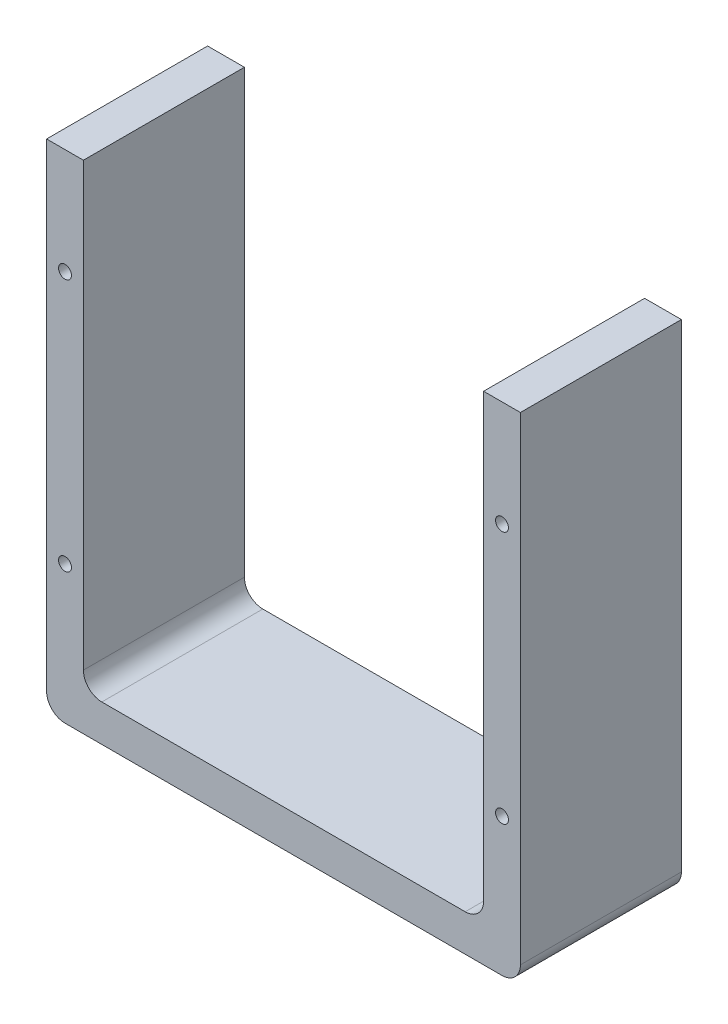
from build123d import *

# Parameters (mm, degrees)
EXTRUDE_1_DEPTH         = 35
HOLE_WIZARD_2_8_2_8_1_D = 2.8
CUT_EXTRUDE_3_DEPTH     = 2
FILLET_1_R              = 4


with BuildPart() as part:
    # 草图1 → 凸台-拉伸1 (new body)
    with BuildSketch(Plane.XY):
        Polygon((-43.5, 0), (43.5, 0), (43.5, 100), (51.5, 100), (51.5, -8), (-51.5, -8), (-51.5, 100), (-43.5, 100), align=None)
    extrude(amount=EXTRUDE_1_DEPTH)

    # Ø2.8 (2.8) 直径孔1 (through all)
    with Locations(Plane(origin=(-47.5, 77, 35), x_dir=(1, 0, 0), z_dir=(0, 0, 1))):
        with Locations((0, 0), (0, -55), (95, 0), (95, -55)):
            Hole(HOLE_WIZARD_2_8_2_8_1_D / 2)

    # 草图9 → 切除-拉伸3 (cut)
    # profile 1 of 7: a face of its own
    with BuildSketch(Plane(origin=(0, -8, 0), x_dir=(-1, 0, 0), z_dir=(0, -1, 0))):
        with BuildLine():
            add(Edge.make_bspline(
                [(34.494342616, -25.308657951), (34.258490625, -25.333538102), (33.801818517, -25.381712683), (33.134982715, -25.435177242), (32.508837628, -25.462052569), (32.104333749, -25.468566512), (31.909454133, -25.471704763)],
                knots=[0, 0, 0, 0, 1.098269963, 2.126542395, 3.097416077, 4, 4, 4, 4], degree=3))
            add(Edge.make_bspline(
                [(31.909454133, -25.471704763), (31.681374623, -25.468801129), (31.243233607, -25.463223244), (30.614744848, -25.417037562), (30.044429573, -25.33495608), (29.532913621, -25.219109182), (29.076312873, -25.080021302), (28.677819074, -24.901879217), (28.340206718, -24.685415334), (28.058385014, -24.440551054), (27.828664862, -24.173586894), (27.629546662, -23.902561565), (27.457027285, -23.628547941), (27.31602445, -23.34801842), (27.208155979, -23.061282124), (27.133679694, -22.769010993), (27.082589746, -22.473683611), (27.076681281, -22.274608251), (27.073724294, -22.17497776)],
                knots=[0, 0, 0, 0, 1.656764413, 3.182646454, 4.574469816, 5.83831686, 6.989545023, 8.036755164, 8.998380809, 9.892496516, 10.738600133, 11.551387336, 12.334304171, 13.087951125, 13.828440517, 14.554832487, 15.27674249, 16, 16, 16, 16], degree=3))
            add(Edge.make_bspline(
                [(27.073724294, -22.17497776), (27.079010863, -22.0922224), (27.088847141, -21.938246395), (27.224986682, -21.783982599), (27.375659794, -21.708880065), (27.537312114, -21.656267589), (27.742199562, -21.598886894), (28.005985747, -21.55748502), (28.339513444, -21.478153574), (28.756804205, -21.342466002), (29.27358702, -21.163503948), (29.856675587, -20.936334003), (30.459354632, -20.695962375), (31.019986146, -20.447041001), (31.519026863, -20.216976189), (31.822689911, -20.052829976), (31.965128654, -19.975834173)],
                knots=[0, 0, 0, 0, 0.616062218, 1.146255654, 1.467060059, 1.895064136, 2.438932427, 3.086632722, 3.926886623, 5.048099828, 6.427913268, 8.093453933, 9.815094729, 11.370694428, 12.766675812, 14, 14, 14, 14], degree=3))
            add(Edge.make_bspline(
                [(31.965128654, -19.975834173), (32.230696876, -19.8310237), (32.765362511, -19.539478337), (33.589553158, -19.129098179), (34.443131906, -18.745271301), (35.31945967, -18.374154407), (36.224761516, -18.028734706), (37.155728106, -17.702730939), (38.11310751, -17.396105492), (38.763529775, -17.210254425), (39.091467364, -17.116549836)],
                knots=[0, 0, 0, 0, 0.943150439, 1.898834601, 2.870009037, 3.861078716, 4.86591296, 5.890797553, 6.936557366, 8, 8, 8, 8], degree=3))
            add(Edge.make_bspline(
                [(39.091467364, -17.116549836), (39.263956605, -17.06074966), (39.627890677, -16.943017184), (40.056916094, -16.732072155), (40.377654163, -16.554110391), (40.557253303, -16.438187065), (40.668494045, -16.345449321), (40.730021135, -16.250308088), (40.687559213, -16.138620425), (40.613121272, -16.130512967), (40.574795678, -16.12633871)],
                knots=[0, 0, 0, 0, 2.09431061, 4.418774081, 5.510155631, 6.33920119, 6.881598625, 7.190089962, 7.583004544, 8, 8, 8, 8], degree=3))
            add(Edge.make_bspline(
                [(40.574795678, -16.12633871), (40.545575029, -16.12997247), (40.458538778, -16.140795942), (40.28931993, -16.180286345), (40.03752369, -16.239831685), (39.704830157, -16.323732166), (39.289481108, -16.430762952), (38.794925069, -16.567882098), (38.216356637, -16.722010805), (37.348010751, -16.956854198), (36.238525999, -17.270835521), (34.937158487, -17.659318261), (33.701291696, -18.055379007), (32.903110119, -18.333187282), (32.513920363, -18.46864535)],
                knots=[0, 0, 0, 0, 0.126157831, 0.375772099, 0.743735789, 1.23570113, 1.846204016, 2.582241057, 3.435391271, 4.412622142, 6.437933321, 8.3775469, 10.233708122, 12, 12, 12, 12], degree=3))
            add(Edge.make_bspline(
                [(32.513920363, -18.46864535), (32.336572622, -18.524518581), (31.992755716, -18.632837757), (31.546116136, -18.689967248), (31.198688298, -18.645729212), (30.944170953, -18.541042485), (30.700476725, -18.362731385), (30.472622932, -18.132141562), (30.279261564, -17.875289532), (30.125415387, -17.624623823), (30.035131631, -17.383938193), (30.001688662, -17.163330999), (30.033749638, -16.960925259), (30.171668811, -16.810428036), (30.387752127, -16.733689724), (30.551436575, -16.726789322), (30.644847152, -16.722851436)],
                knots=[0, 0, 0, 0, 1.860827006, 3.607510199, 4.451898819, 5.338891502, 6.329136044, 7.454987538, 8.572205675, 9.541608196, 10.389533756, 11.125176222, 11.762744684, 12.364370433, 13.066587555, 14, 14, 14, 14], degree=3))
            add(Edge.make_bspline(
                [(30.644847152, -16.722851436), (30.671391881, -16.723782492), (30.739370278, -16.726166831), (30.863896246, -16.744933256), (31.034559161, -16.773137912), (31.24889464, -16.809090353), (31.503075696, -16.845750184), (31.789666216, -16.872862211), (32.108109071, -16.888236309), (32.457000282, -16.892632663), (32.840130044, -16.879448787), (33.255960586, -16.824599782), (33.705659399, -16.736121254), (34.014854419, -16.656847029), (34.176202495, -16.615479146)],
                knots=[0, 0, 0, 0, 0.267803296, 0.685817475, 1.268446124, 2.013769011, 2.878091811, 3.858832357, 4.916688979, 6.093629303, 7.378595283, 8.780258777, 10.319833707, 12, 12, 12, 12], degree=3))
            add(Edge.make_bspline(
                [(34.176202495, -16.615479146), (34.104956468, -16.272982549), (33.958031502, -15.566679287), (33.828729373, -14.457313373), (33.735779785, -13.275280982), (33.727246435, -12.461309067), (33.722852823, -12.042214907)],
                knots=[0, 0, 0, 0, 0.911268396, 1.879235723, 2.908070529, 4, 4, 4, 4], degree=3))
            add(Edge.make_bspline(
                [(33.722852823, -12.042214907), (33.725252365, -11.773084485), (33.729911337, -11.25053848), (33.762764126, -10.488046508), (33.811972585, -9.768880153), (33.88799891, -9.092460669), (33.983410049, -8.458378383), (34.095521169, -7.866796645), (34.236243774, -7.319085314), (34.393426235, -6.817442491), (34.562832568, -6.368182863), (34.734565929, -5.975497131), (34.902100433, -5.641198124), (35.072875459, -5.36728258), (35.243366711, -5.152877618), (35.414044274, -4.994353014), (35.594059887, -4.899336366), (35.716996747, -4.883542171), (35.774856603, -4.876108682)],
                knots=[0, 0, 0, 0, 1.660621842, 3.224278042, 4.708583054, 6.107757518, 7.423031884, 8.664648095, 9.821231968, 10.910336106, 11.906928089, 12.782288535, 13.554158693, 14.212240814, 14.770488627, 15.239867084, 15.642245773, 16, 16, 16, 16], degree=3))
            add(Edge.make_bspline(
                [(35.774856603, -4.876108682), (35.843945508, -4.882954289), (35.986751385, -4.89710407), (36.093544306, -4.99341576), (36.148671245, -5.043132245)],
                knots=[0, 0, 0, 0, 0.967591897, 2, 2, 2, 2], degree=3))
            add(Edge.make_bspline(
                [(36.148671245, -5.043132245), (36.194580125, -5.07829002), (36.295403892, -5.155502518), (36.468806653, -5.263519155), (36.673533678, -5.377282655), (36.913291503, -5.483796445), (37.179361366, -5.607592186), (37.481529945, -5.722346164), (37.813083344, -5.848942599), (38.309408832, -6.013836686), (38.960934568, -6.274096173), (39.733957212, -6.712646539), (40.514051289, -7.259177574), (41.007048198, -7.693192835), (41.26277369, -7.918323589)],
                knots=[0, 0, 0, 0, 0.351849876, 0.772722615, 1.242233516, 1.776553746, 2.368961093, 3.028323994, 3.743315977, 4.52937233, 6.212282938, 8.004084058, 9.927253601, 12, 12, 12, 12], degree=3))
            add(Edge.make_bspline(
                [(41.26277369, -7.918323589), (41.073449367, -7.88127359), (40.710438359, -7.810233813), (40.186959577, -7.728401203), (39.706014516, -7.683292889), (39.400406086, -7.675489968), (39.254514176, -7.671764995)],
                knots=[0, 0, 0, 0, 1.142261067, 2.190174698, 3.136022296, 4, 4, 4, 4], degree=3))
            add(Edge.make_bspline(
                [(39.254514176, -7.671764995), (39.092448397, -7.675762221), (38.781183476, -7.683439328), (38.337276632, -7.757735804), (37.934111393, -7.867747164), (37.579728976, -8.040036543), (37.264421291, -8.249554983), (36.99750853, -8.512870862), (36.780597697, -8.826065692), (36.60901278, -9.18267363), (36.466819852, -9.574235796), (36.351368389, -9.998715261), (36.240404532, -10.449637949), (36.161460697, -10.932761271), (36.089853023, -11.442775445), (36.052056349, -11.983565294), (36.015768507, -12.553399062), (36.010199829, -13.135883387), (36.023104357, -13.694259694), (36.081331675, -14.192480253), (36.174969289, -14.612975187), (36.314637962, -14.954801946), (36.488262767, -15.226155782), (36.714064302, -15.414202483), (36.986337293, -15.516607792), (37.177794663, -15.517453039), (37.278068674, -15.517895728)],
                knots=[0, 0, 0, 0, 1.130634408, 2.171506114, 3.135274017, 4.037847091, 4.910741944, 5.768187862, 6.638723801, 7.557712487, 8.52409939, 9.543806789, 10.628217911, 11.764973909, 12.96018513, 14.22315397, 15.548875705, 16.946700773, 18.289663121, 19.445812645, 20.444893759, 21.287217766, 22.013764226, 22.671548483, 23.304235909, 24, 24, 24, 24], degree=3))
            add(Edge.make_bspline(
                [(37.278068674, -15.517895728), (37.38795955, -15.447433296), (37.599101491, -15.312048308), (37.904981367, -15.120561683), (38.187998538, -14.951503245), (38.44182882, -14.794391835), (38.672701681, -14.659481892), (38.878970921, -14.543015389), (39.062337186, -14.449563953), (39.263695911, -14.342795002), (39.494748105, -14.246360657), (39.752822704, -14.155498007), (39.991815692, -14.102479254), (40.221045477, -14.08321242), (40.458955746, -14.108719461), (40.720343311, -14.191941231), (41.018222936, -14.314711061), (41.330487359, -14.483317299), (41.628700514, -14.670377433), (41.859492823, -14.888458104), (42.004655064, -15.12960996), (42.044131667, -15.382010441), (42.023245943, -15.612380912), (42.003755365, -15.821530895), (41.944382531, -15.996771959), (41.875026794, -16.149738614), (41.760333237, -16.275133824), (41.588856051, -16.355386185), (41.374099926, -16.416517519), (41.153139527, -16.425052988), (40.93263684, -16.460239994), (40.707514604, -16.527744407), (40.432140846, -16.636440209), (40.104346598, -16.786497429), (39.722849241, -16.974219868), (39.287144413, -17.19945995), (38.800839339, -17.468865178), (38.095814357, -17.867645435), (37.226733367, -18.380006164), (36.246436075, -18.981160015), (35.374104129, -19.559288329), (34.357087479, -20.27713191), (33.202109713, -21.166743168), (32.211916468, -21.9667111), (31.591163913, -22.484241125), (31.339353406, -22.726225874), (31.116518713, -22.937286957), (30.940505155, -23.138614213), (30.801850154, -23.319066606), (30.697739113, -23.479372648), (30.634182564, -23.62309098), (30.61223472, -23.751682681), (30.621924168, -23.8647779), (30.66898667, -23.959170172), (30.740964765, -24.040097649), (30.843250848, -24.100701828), (30.968424179, -24.153880372), (31.121856546, -24.187785255), (31.301866174, -24.206186606), (31.430866865, -24.209371463), (31.499848727, -24.211074534)],
                knots=[0, 0, 0, 0, 1.061888572, 2.040289632, 2.935339984, 3.743486433, 4.468434798, 5.110450983, 5.669919155, 6.142527667, 6.963733175, 7.703682882, 8.365672114, 8.94954706, 9.56757135, 10.297793297, 11.172875236, 12.185842041, 13.181734337, 14.028110574, 14.74766592, 15.426649783, 16.06366612, 16.629437485, 17.127325253, 17.561330884, 17.988586405, 18.47573265, 19.080059409, 19.795726115, 20.265496853, 20.893505724, 21.702514963, 22.672561629, 23.825128046, 25.161040197, 26.661886764, 28.347101093, 31.749871446, 34.867992262, 37.700155877, 40.261079691, 44.992783078, 49.55484035, 50.617987376, 51.563942179, 52.395069642, 53.11325017, 53.736519985, 54.24515103, 54.665686337, 55.004278042, 55.297209517, 55.572122048, 55.847034578, 56.167090459, 56.529564641, 56.950652557, 57.438871681, 58, 58, 58, 58], degree=3))
            add(Edge.make_bspline(
                [(31.499848727, -24.211074534), (31.719991608, -24.20974301), (32.123594743, -24.207301834), (32.673265665, -24.16755465), (33.113926654, -24.111219264), (33.464219711, -24.017352639), (33.756273043, -23.88040907), (34.028688434, -23.700170228), (34.303838231, -23.478406677), (34.56206589, -23.211431367), (34.805546485, -22.944968148), (35.036736259, -22.719929086), (35.234714897, -22.535923367), (35.459387613, -22.367856188), (35.713405733, -22.219875466), (36.027713476, -22.16151475), (36.325770199, -22.188589747), (36.617935765, -22.258412052), (36.910055002, -22.328692185), (37.164316951, -22.350655078), (37.385633221, -22.325873296), (37.584438842, -22.255239646), (37.819587127, -22.151458424), (38.083857358, -22.006329427), (38.377603769, -21.844102405), (38.710679008, -21.70972586), (39.066111818, -21.57899806), (39.440305699, -21.473689366), (39.807567209, -21.385923063), (40.145212636, -21.332098301), (40.441649535, -21.296294653), (40.775373244, -21.315502952), (41.14437949, -21.340148718), (41.544379889, -21.360322885), (41.88632807, -21.332905276), (42.109197043, -21.245087801), (42.225215117, -21.144862794), (42.291475581, -21.061163128), (42.375173697, -20.954028472), (42.474683313, -20.820551013), (42.581638482, -20.653980332), (42.703414966, -20.461668264), (42.839454933, -20.242092407), (43.138172722, -19.740811454), (43.568326937, -18.953429391), (43.964359982, -18.03644145), (44.22377397, -17.294393001), (44.389401911, -16.743284962), (44.51746135, -16.196009477), (44.588941981, -15.74497136), (44.640478417, -15.404298737), (44.698649799, -15.184696427), (44.757255222, -14.994791336), (44.839412599, -14.843032863), (44.924443118, -14.71874587), (45.027099931, -14.633135683), (45.139494904, -14.57590655), (45.265339952, -14.561380356), (45.395782434, -14.584070023), (45.531453549, -14.636975612), (45.664516974, -14.732040719), (45.802717043, -14.858223144), (45.940135572, -15.022222257), (46.078557292, -15.223327655), (46.221516737, -15.458579262), (46.406582778, -15.802533312), (46.607745237, -16.214823896), (46.799196343, -16.655057946), (46.918096278, -17.009211837), (46.963864027, -17.290886795), (46.939505121, -17.51632953), (46.886516727, -17.710037457), (46.787903666, -17.882603684), (46.697187775, -17.975984529), (46.651271988, -18.023249181)],
                knots=[0, 0, 0, 0, 2.047655783, 3.754108648, 5.125043773, 6.17540043, 7.113458309, 8.112376389, 9.208372525, 10.394419429, 11.563545005, 12.56649023, 13.396125574, 14.074454979, 15.17792013, 16.094655726, 16.997093233, 17.942902454, 18.888711675, 19.791149182, 20.300559183, 20.948026068, 21.743210678, 22.692150795, 23.751376247, 24.862328658, 26.028784026, 27.273954936, 28.476621889, 29.539073526, 30.455809122, 31.245523204, 32.641853264, 33.900389974, 34.968196923, 35.818476722, 36.063284981, 36.387018423, 36.808880887, 37.329367919, 37.934829339, 38.649945855, 39.447422619, 40.337897793, 44.07926958, 47.786168859, 49.615528799, 51.391047388, 53.138196613, 54.839337514, 55.640240208, 56.340200359, 56.952531598, 57.482144324, 57.940968189, 58.34364494, 58.71323146, 59.098732217, 59.498185227, 59.935625007, 60.44189001, 61.009354099, 61.674207292, 62.426940528, 63.279364343, 64.234137264, 66.059876641, 67.546533576, 68.697234181, 69.530984579, 70.175272103, 70.791935198, 71.388538816, 72, 72, 72, 72], degree=3))
            add(Edge.make_bspline(
                [(46.651271988, -18.023249181), (46.520839181, -18.147566031), (46.243364709, -18.412029805), (45.868126687, -18.899391394), (45.495458622, -19.48126173), (45.148138028, -20.136870164), (44.836864507, -20.799766383), (44.61070079, -21.421168774), (44.453502782, -21.969765685), (44.433496254, -22.317305784), (44.424291142, -22.477210874)],
                knots=[0, 0, 0, 0, 0.851095909, 1.810567393, 2.899122285, 4.116405811, 5.31696411, 6.358151179, 7.244576424, 8, 8, 8, 8], degree=3))
            add(Edge.make_bspline(
                [(44.424291142, -22.477210874), (44.426735889, -22.543935407), (44.431403487, -22.671328249), (44.484268083, -22.851664644), (44.555489729, -23.017459671), (44.667005369, -23.151472603), (44.77707629, -23.268732194), (44.856809515, -23.385640781), (44.905502291, -23.497044756), (44.913630486, -23.569128354), (44.917408329, -23.602631552)],
                knots=[0, 0, 0, 0, 1.266671467, 2.418374039, 3.559507758, 4.675782117, 5.713912786, 6.624413615, 7.360651451, 8, 8, 8, 8], degree=3))
            add(Edge.make_bspline(
                [(44.917408329, -23.602631552), (44.915393067, -23.645278502), (44.91168343, -23.723781788), (44.835234709, -23.818525972), (44.724416505, -23.876285102), (44.575442792, -23.887254371), (44.398195243, -23.85557107), (44.193232915, -23.77857261), (43.971748459, -23.639076742), (43.725251221, -23.46692831), (43.478160839, -23.245687917), (43.243045856, -22.985348396), (43.02397088, -22.690538281), (42.895390609, -22.475743005), (42.829613785, -22.365861832)],
                knots=[0, 0, 0, 0, 0.519166818, 0.955667432, 1.443899962, 2.042773864, 2.779402717, 3.679233812, 4.753920395, 6.033970115, 7.427609821, 8.878995963, 10.403411892, 12, 12, 12, 12], degree=3))
            add(Edge.make_bspline(
                [(42.829613785, -22.365861832), (42.658169037, -22.502775002), (42.32430488, -22.769393841), (41.799186596, -23.109004487), (41.282565539, -23.404489878), (40.748090489, -23.643896498), (40.171964951, -23.856075157), (39.523407911, -24.053704045), (38.789950908, -24.263510944), (38.268781364, -24.390598959), (37.993883947, -24.457633128)],
                knots=[0, 0, 0, 0, 0.988469882, 1.92490389, 2.815845998, 3.668950564, 4.561394412, 5.581999518, 6.724595297, 8, 8, 8, 8], degree=3))
            add(Edge.make_bspline(
                [(37.993883947, -24.457633128), (37.992093117, -24.585309308), (37.988787578, -24.820975789), (38.047341385, -25.142801223), (38.132910157, -25.414653649), (38.244133227, -25.54838652), (38.296117061, -25.610891066)],
                knots=[0, 0, 0, 0, 1.249747246, 2.306800947, 3.208626592, 4, 4, 4, 4], degree=3))
            add(Edge.make_bspline(
                [(38.296117061, -25.610891066), (38.389067713, -25.709005945), (38.58585827, -25.916729953), (38.863849068, -26.270879174), (39.148252902, -26.675508225), (39.376453426, -27.043323645), (39.551349036, -27.342710659), (39.668910257, -27.547710072), (39.766881739, -27.730123796), (39.852718214, -27.888712475), (39.915460342, -28.026024915), (39.960273446, -28.140152143), (39.991249223, -28.229912187), (40.000815867, -28.316235255), (39.995914977, -28.395996267), (39.968573092, -28.470103104), (39.916623543, -28.521844037), (39.818783232, -28.530210782), (39.691490443, -28.506804016), (39.605467634, -28.446083718), (39.560724042, -28.414500882)],
                knots=[0, 0, 0, 0, 1.905801276, 4.034868934, 6.343605774, 8.880886691, 10.138139665, 11.235271678, 12.214328667, 13.059169618, 13.778835615, 14.341407137, 14.790997893, 15.111099065, 15.561466989, 15.905271685, 16.209693934, 16.532514792, 17.236707574, 18, 18, 18, 18], degree=3))
            add(Edge.make_bspline(
                [(39.560724042, -28.414500882), (39.403548103, -28.323266995), (39.081195787, -28.136155309), (38.55002802, -27.921618424), (37.971889549, -27.751509443), (37.368241668, -27.649002642), (36.792063389, -27.550040496), (36.293927257, -27.418147032), (35.891821846, -27.26206672), (35.562814499, -27.066328308), (35.29638536, -26.774665443), (35.033542547, -26.394044574), (34.760314231, -25.893388947), (34.588383526, -25.515404204), (34.494342616, -25.308657951)],
                knots=[0, 0, 0, 0, 1.035455561, 2.123617016, 3.25772031, 4.466224904, 5.612486143, 6.591909082, 7.399205128, 8.068400819, 8.752799766, 9.631727786, 10.704626532, 12, 12, 12, 12], degree=3))
        make_face()
    # profile 2 of 7: a face of its own
    with BuildSketch(Plane(origin=(0, -8, 0), x_dir=(-1, 0, 0), z_dir=(0, -1, 0))):
        with BuildLine():
            add(Edge.make_bspline(
                [(6.931477886, -11.290608871), (6.762774879, -11.188156486), (6.393814199, -10.964088744), (5.771061029, -10.63952788), (5.042174999, -10.279176747), (4.199475686, -9.901474146), (3.246078961, -9.494835357), (2.181597482, -9.06440172), (1.008341569, -8.601055087), (0.18609857, -8.293443156), (-0.242581842, -8.13306817)],
                knots=[0, 0, 0, 0, 0.603396511, 1.319653941, 2.146276314, 3.089592408, 4.14288787, 5.315605939, 6.600478015, 8, 8, 8, 8], degree=3))
            add(Edge.make_bspline(
                [(-0.242581842, -8.13306817), (-0.361146483, -8.081838321), (-0.581085411, -7.986806293), (-0.8441762, -7.768720763), (-1.008115083, -7.497405758), (-1.027939589, -7.29869291), (-1.037932145, -7.198531565)],
                knots=[0, 0, 0, 0, 1.179604305, 2.188181115, 3.086751476, 4, 4, 4, 4], degree=3))
            add(Edge.make_bspline(
                [(-1.037932145, -7.198531565), (-1.032277979, -7.135489514), (-1.021246882, -7.01249649), (-0.942030419, -6.839405034), (-0.801259682, -6.701386816), (-0.612472215, -6.590162573), (-0.372325188, -6.504247536), (-0.082228244, -6.442949791), (0.260338694, -6.408941931), (0.504969388, -6.405193379), (0.636280242, -6.403181263)],
                knots=[0, 0, 0, 0, 0.736488883, 1.436866238, 2.171231965, 3.005879713, 3.98182579, 5.140111813, 6.464892722, 8, 8, 8, 8], degree=3))
            add(Edge.make_bspline(
                [(0.636280242, -6.403181263), (0.793328503, -6.408895491), (1.108710908, -6.420370734), (1.567177791, -6.52560271), (2.006573647, -6.626584411), (2.418875568, -6.656971126), (2.769391491, -6.642115483), (3.062977445, -6.598083636), (3.330123884, -6.541286291), (3.617438322, -6.530484057), (3.94078789, -6.571974727), (4.192706565, -6.673783908), (4.378746037, -6.784340136), (4.516603955, -6.865780414), (4.684762829, -6.974945478), (4.883593648, -7.110259851), (5.112710231, -7.274180243), (5.376284762, -7.459060665), (5.6656364, -7.677427335), (6.09045581, -7.983580703), (6.600352337, -8.374888685), (7.158053351, -8.825994387), (7.632719216, -9.243206488), (7.908484047, -9.522167013), (8.037014806, -9.652187248)],
                knots=[0, 0, 0, 0, 1.22108369, 2.452165384, 3.652870209, 4.729786796, 5.659906057, 6.379736863, 7.040018581, 7.784025167, 8.607526774, 9.562302711, 9.872208732, 10.293619004, 10.809119108, 11.433386589, 12.166714481, 13.003251153, 13.940733176, 14.989772133, 17.081591596, 18.945608185, 20.57638373, 22, 22, 22, 22], degree=3))
            add(Edge.make_bspline(
                [(8.037014806, -9.652187248), (8.138043477, -9.577763508), (8.347838089, -9.423216292), (8.693567847, -9.214279502), (9.077420388, -9.020171039), (9.482763499, -8.843317109), (9.884301589, -8.690953309), (10.255722012, -8.577895407), (10.585015033, -8.509739735), (10.790010817, -8.496890306), (10.884368889, -8.490975806)],
                knots=[0, 0, 0, 0, 0.966963857, 2.007982554, 3.109391732, 4.280820551, 5.415848299, 6.418128687, 7.271876114, 8, 8, 8, 8], degree=3))
            add(Edge.make_bspline(
                [(10.884368889, -8.490975806), (11.039123787, -8.497783897), (11.348702065, -8.51140309), (11.800804922, -8.649628065), (12.240366368, -8.856473559), (12.639034503, -9.143307037), (12.984077704, -9.441523029), (13.247950155, -9.71451916), (13.424937979, -9.95536054), (13.456128236, -10.119821142), (13.469257371, -10.189048702)],
                knots=[0, 0, 0, 0, 1.133282512, 2.267066513, 3.442574607, 4.687331109, 5.860297648, 6.782987224, 7.487714231, 8, 8, 8, 8], degree=3))
            add(Edge.make_bspline(
                [(13.469257371, -10.189048702), (13.465646871, -10.221781984), (13.458677975, -10.28496293), (13.395624469, -10.366939709), (13.289073362, -10.402512106), (13.113312994, -10.419046211), (12.87271392, -10.402279958), (12.577346751, -10.342394688), (12.246212376, -10.274587018), (11.925977982, -10.266900746), (11.623690305, -10.284663275), (11.356796715, -10.33395157), (11.060697375, -10.422081108), (10.739686376, -10.531527296), (10.417687572, -10.674272256), (10.112420618, -10.847952555), (9.835501235, -11.051983459), (9.672389914, -11.21177922), (9.591924647, -11.290608871)],
                knots=[0, 0, 0, 0, 0.364332098, 0.70322453, 1.089621353, 1.583637721, 2.684987992, 3.772311608, 4.964656659, 6.466836383, 7.345672739, 8.357232043, 9.500402477, 10.807024416, 12.157533899, 13.442337501, 14.738266634, 16, 16, 16, 16], degree=3))
            add(Edge.make_bspline(
                [(9.591924647, -11.290608871), (9.682995596, -11.364660523), (9.89226125, -11.534818708), (10.292798626, -11.756724949), (10.80227497, -11.999597603), (11.397521261, -12.244040356), (12.0122817, -12.488837603), (12.572424882, -12.742983535), (13.053798665, -12.986405212), (13.337708944, -13.161885799), (13.469257371, -13.243193863)],
                knots=[0, 0, 0, 0, 0.645973334, 1.484337577, 2.513781207, 3.758177618, 5.029567455, 6.160976736, 7.147897638, 8, 8, 8, 8], degree=3))
            add(Edge.make_bspline(
                [(13.469257371, -13.243193863), (13.479640605, -12.996542437), (13.499641673, -12.521421499), (13.553239543, -11.838759777), (13.61284254, -11.213315), (13.696933439, -10.648271072), (13.794665116, -10.140818287), (13.910128139, -9.692410692), (14.032978279, -9.298852292), (14.182253727, -8.96529608), (14.342272023, -8.684094075), (14.484933558, -8.433839524), (14.634854039, -8.228910204), (14.770739032, -8.052771576), (14.911702487, -7.92278001), (15.042832634, -7.820583339), (15.176109338, -7.763703181), (15.344030539, -7.735633764), (15.552362824, -7.778796641), (15.775211367, -7.923780137), (15.963259222, -8.160139868), (16.11666695, -8.465830878), (16.24259489, -8.815609452), (16.339069195, -9.184182046), (16.394642285, -9.561597561), (16.417712535, -10.059274066), (16.387853281, -10.652548504), (16.313942562, -11.20937858), (16.234538222, -11.578096737), (16.177712444, -11.778521955), (16.136019669, -11.887196526), (16.065487375, -11.972347517), (16.006391662, -11.880576931), (15.990370037, -11.760186914), (15.974653875, -11.54350179), (15.971752705, -11.279016209), (15.962707508, -11.010730006), (15.94353793, -10.794086092), (15.897072875, -10.657230974), (15.81653917, -10.590582885), (15.752514942, -10.6186741), (15.707739981, -10.66974028), (15.65985496, -10.74794782), (15.601704423, -10.854351201), (15.544369355, -10.991911197), (15.485936726, -11.16172272), (15.417491328, -11.359869488), (15.317696353, -11.679475233), (15.207066346, -12.145804628), (15.096639677, -12.78043898), (15.011695911, -13.513516425), (14.973083488, -14.035721872), (14.952585685, -14.31294002)],
                knots=[0, 0, 0, 0, 2.301215292, 4.432796452, 6.382999205, 8.156873341, 9.756415708, 11.19808469, 12.472063677, 13.595048615, 14.59609593, 15.488333188, 16.277000239, 16.962154596, 17.55660848, 18.060855814, 18.50383983, 18.891878449, 19.633544408, 20.422114636, 21.325577585, 22.414525787, 23.599122758, 24.786037925, 25.960471495, 27.148415519, 29.424374412, 31.495343927, 32.355867129, 32.973750484, 33.371698066, 33.564730997, 33.748440926, 34.144079315, 34.800898331, 35.715699628, 36.630918165, 37.303815551, 37.724157924, 37.984843197, 38.129485982, 38.321726167, 38.616502509, 38.981420045, 39.451985989, 40.003115776, 40.655736332, 41.406203934, 43.12360847, 45.118711631, 47.408717722, 50, 50, 50, 50], degree=3))
            add(Edge.make_bspline(
                [(14.952585685, -14.31294002), (15.024381615, -14.30697093), (15.148103275, -14.296684753), (15.302195726, -14.306125386), (15.413699409, -14.331955532), (15.459784409, -14.416457074), (15.408591417, -14.506904306), (15.301031312, -14.57979974), (15.13472073, -14.658637295), (15.000958504, -14.701883155), (14.924748425, -14.726522177)],
                knots=[0, 0, 0, 0, 1.469447976, 2.532212368, 3.203264403, 3.689297975, 4.249423991, 5.119291706, 6.358736878, 8, 8, 8, 8], degree=3))
            add(Edge.make_bspline(
                [(14.924748425, -14.726522177), (14.928832886, -14.922704996), (14.93667027, -15.299146382), (14.946219964, -15.839980352), (14.9451543, -16.333141127), (14.941676093, -16.778555158), (14.933997247, -17.177601112), (14.922144405, -17.528905919), (14.908033544, -17.834101084), (14.87623877, -18.177051323), (14.816651082, -18.573710751), (14.702194244, -19.034590148), (14.532124136, -19.485897526), (14.323478234, -19.91512053), (14.117008946, -20.309811196), (13.957881095, -20.658201857), (13.844265744, -20.946897719), (13.785429737, -21.181072503), (13.751227642, -21.36490298), (13.687073991, -21.493786624), (13.603445472, -21.583962516), (13.489702612, -21.606403541), (13.372099525, -21.578309314), (13.254261, -21.501120386), (13.140024034, -21.374648046), (13.015110919, -21.208267164), (12.900575467, -20.987644957), (12.7831736, -20.72315751), (12.677924953, -20.408431759), (12.6181403, -20.180360611), (12.586418536, -20.059345955)],
                knots=[0, 0, 0, 0, 1.814263972, 3.481263286, 5.001010102, 6.373739359, 7.599586726, 8.690992258, 9.623739199, 10.423767452, 11.874592744, 13.328159104, 14.805658098, 16.324267841, 17.738391939, 18.923112626, 19.865552161, 20.599789196, 21.155650834, 21.583208646, 21.921306088, 22.248337564, 22.599296644, 23.017620392, 23.529006519, 24.168789687, 24.936627309, 25.820166698, 26.843379455, 28, 28, 28, 28], degree=3))
            add(Edge.make_bspline(
                [(12.586418536, -20.059345955), (12.315372647, -20.271506437), (11.795260555, -20.678622859), (11.014867775, -21.221095388), (10.27180586, -21.677341122), (9.774068577, -21.922588987), (9.536250126, -22.039768208)],
                knots=[0, 0, 0, 0, 1.13297274, 2.174070319, 3.12757235, 4, 4, 4, 4], degree=3))
            add(Edge.make_bspline(
                [(9.536250126, -22.039768208), (9.498105589, -22.292659901), (9.421808828, -22.798494254), (9.349434995, -23.565788719), (9.298503107, -24.338966773), (9.292632084, -24.857874575), (9.289691532, -25.117773879)],
                knots=[0, 0, 0, 0, 0.992729853, 1.985659779, 2.991100888, 4, 4, 4, 4], degree=3))
            add(Edge.make_bspline(
                [(9.289691532, -25.117773879), (9.289682537, -25.177502317), (9.289666302, -25.285295691), (9.307595531, -25.432648603), (9.326891396, -25.550006361), (9.375658782, -25.673929974), (9.521143777, -25.787510067), (9.7425263, -25.846655755), (9.955941476, -25.897066067), (10.090202423, -25.908734198), (10.140716356, -25.913124181)],
                knots=[0, 0, 0, 0, 1.043299587, 1.882868274, 2.592000528, 3.121571982, 4.172567515, 5.646011873, 7.114342626, 8, 8, 8, 8], degree=3))
            add(Edge.make_bspline(
                [(10.140716356, -25.913124181), (10.188966968, -25.907029345), (10.287807186, -25.894544222), (10.410651293, -25.781834566), (10.500331524, -25.61442563), (10.556087482, -25.405878575), (10.599441314, -25.198118515), (10.658518046, -25.044198505), (10.698752183, -24.928416643), (10.752908068, -24.904104539), (10.773019846, -24.895075794)],
                knots=[0, 0, 0, 0, 0.892733628, 1.828743353, 2.976059925, 4.431270103, 5.866587445, 6.920364169, 7.599057485, 8, 8, 8, 8], degree=3))
            add(Edge.make_bspline(
                [(10.773019846, -24.895075794), (10.7909034, -24.898935481), (10.830190753, -24.907414608), (10.881971862, -24.958335344), (10.910715155, -25.040991235), (10.946443199, -25.147356244), (10.965019262, -25.285903761), (10.988306366, -25.453741428), (10.991571982, -25.653377494), (10.999573205, -25.943670927), (10.984043538, -26.289553437), (10.899918082, -26.648913453), (10.760304999, -26.929365128), (10.543294611, -27.112367413), (10.285762549, -27.213120042), (10.001174292, -27.288989569), (9.679600293, -27.335256269), (9.331885966, -27.352913899), (8.970403269, -27.322231143), (8.628145378, -27.190614384), (8.309921639, -26.987929187), (8.032987456, -26.703612065), (7.7966089, -26.363929955), (7.631568763, -25.971856592), (7.523804097, -25.544006436), (7.5011683, -25.076651292), (7.519563802, -24.575916224), (7.572489752, -24.036831086), (7.660766467, -23.461123839), (7.74102193, -23.066777385), (7.782502709, -22.862955771)],
                knots=[0, 0, 0, 0, 0.165956008, 0.364579245, 0.632175268, 0.964087284, 1.397363311, 1.913437676, 2.523991954, 3.231774177, 4.588812044, 5.695574091, 6.612867331, 7.417507705, 8.242609852, 9.139386739, 10.126413123, 11.225616706, 12.3426215, 13.435100401, 14.565551996, 15.790677167, 17.063188564, 18.352898412, 19.684577129, 21.103293114, 22.641434985, 24.296233824, 26.085674175, 28, 28, 28, 28], degree=3))
            add(Edge.make_bspline(
                [(7.782502709, -22.862955771), (7.608194453, -22.924651408), (7.278332258, -23.041404674), (6.801238662, -23.175579826), (6.369430755, -23.255529154), (6.096626985, -23.269845642), (5.96910402, -23.276537928)],
                knots=[0, 0, 0, 0, 1.187325551, 2.246903387, 3.180509568, 4, 4, 4, 4], degree=3))
            add(Edge.make_bspline(
                [(5.96910402, -23.276537928), (5.810049374, -23.265174774), (5.486424436, -23.242054418), (5.012154321, -23.068487857), (4.555736795, -22.78413683), (4.133698152, -22.40881344), (3.769575372, -21.992352218), (3.489658487, -21.577842471), (3.315987085, -21.172486625), (3.289382897, -20.902443629), (3.276843246, -20.775161227)],
                knots=[0, 0, 0, 0, 0.96223691, 1.957841971, 3.021105995, 4.2049106, 5.366053403, 6.363923044, 7.22884945, 8, 8, 8, 8], degree=3))
            add(Edge.make_bspline(
                [(3.276843246, -20.775161227), (3.278893971, -20.723236436), (3.282788636, -20.624622718), (3.318100577, -20.487348684), (3.379507043, -20.369687457), (3.43828188, -20.308647516), (3.467727319, -20.278067288)],
                knots=[0, 0, 0, 0, 1.13425579, 2.154138289, 3.075246964, 4, 4, 4, 4], degree=3))
            add(Edge.make_bspline(
                [(3.467727319, -20.278067288), (3.645017943, -20.117011019), (4.017913968, -19.778260776), (4.41542595, -19.259882118), (4.769044803, -18.800157128), (5.098374377, -18.421860245), (5.48465854, -18.017397885), (5.838514586, -17.672580701), (6.13009239, -17.394701373), (6.347526064, -17.217409398), (6.545549371, -17.058810497), (6.73413016, -16.931521326), (6.911518565, -16.837180434), (7.070942527, -16.758826864), (7.222572685, -16.722683274), (7.365366016, -16.698295556), (7.51047535, -16.728858439), (7.664162645, -16.794068549), (7.827704468, -16.910355866), (7.999716416, -17.071574876), (8.189026602, -17.271926508), (8.385507531, -17.519940405), (8.596245681, -17.811545004), (8.737624569, -18.022763186), (8.812481351, -18.134598223)],
                knots=[0, 0, 0, 0, 2.116552525, 4.45175272, 5.764140705, 7.253504398, 8.888857214, 10.714627044, 11.628077574, 12.45302795, 13.197224127, 13.874260586, 14.462467622, 14.977249123, 15.438401069, 15.840177266, 16.245367086, 16.729255094, 17.311933414, 18.009806623, 18.815156771, 19.749920785, 20.808636211, 22, 22, 22, 22], degree=3))
            add(Edge.make_bspline(
                [(8.812481351, -18.134598223), (8.857209528, -18.010717899), (8.944109171, -17.770038384), (9.031806174, -17.410739594), (9.076083308, -17.065876163), (9.06730976, -16.843563496), (9.063016696, -16.734781691)],
                knots=[0, 0, 0, 0, 1.101740766, 2.140504842, 3.090113742, 4, 4, 4, 4], degree=3))
            add(Edge.make_bspline(
                [(9.063016696, -16.734781691), (8.925123256, -16.742427833), (8.648757991, -16.757752187), (8.230529329, -16.713965082), (7.812721819, -16.62283616), (7.403815264, -16.481068447), (7.018744005, -16.295051481), (6.682484312, -16.055855649), (6.401036413, -15.771908409), (6.185475662, -15.45456698), (6.026857771, -15.139448724), (5.903229444, -14.860551428), (5.827424919, -14.62324774), (5.801601084, -14.423587289), (5.807787517, -14.263453088), (5.820883635, -14.135246165), (5.831714209, -14.034949761), (5.852914428, -13.98131582), (5.861731729, -13.959009136)],
                knots=[0, 0, 0, 0, 1.355393591, 2.716472295, 4.116761229, 5.55046493, 6.960355958, 8.30512772, 9.585577401, 10.868410548, 12.057032088, 13.049154984, 13.865203491, 14.495375928, 15.016627216, 15.435325939, 15.765148599, 16, 16, 16, 16], degree=3))
            add(Edge.make_bspline(
                [(5.861731729, -13.959009136), (5.898298574, -13.893127614), (5.976890929, -13.75152984), (6.087251525, -13.512206907), (6.209445547, -13.23658008), (6.341220353, -12.92304326), (6.475524501, -12.568991194), (6.623306167, -12.179118659), (6.772831761, -11.746749561), (6.877081972, -11.447008465), (6.931477886, -11.290608871)],
                knots=[0, 0, 0, 0, 0.628116523, 1.349997691, 2.196234781, 3.142598718, 4.18539914, 5.353641049, 6.61917678, 8, 8, 8, 8], degree=3))
        make_face()
        with BuildLine():
            add(Edge.make_bspline(
                [(8.828388357, -18.401040575), (8.745754666, -18.337754715), (8.583197093, -18.213258331), (8.379665852, -18.19251702), (8.279596648, -18.182319241)],
                knots=[0, 0, 0, 0, 1.01666984, 2, 2, 2, 2], degree=3))
            add(Edge.make_bspline(
                [(8.279596648, -18.182319241), (8.210266719, -18.187734919), (8.068877277, -18.198779494), (7.857008615, -18.265117435), (7.650592861, -18.380954281), (7.440402057, -18.533845721), (7.234689207, -18.734533295), (7.033970419, -18.981066272), (6.823892023, -19.263746149), (6.6288719, -19.584886513), (6.438963815, -19.90820047), (6.272217315, -20.213435805), (6.132917918, -20.488609225), (6.016615807, -20.73208141), (5.922410907, -20.945738394), (5.860655725, -21.132637763), (5.814765627, -21.287339976), (5.808701954, -21.382058887), (5.806057208, -21.423371724)],
                knots=[0, 0, 0, 0, 0.777329582, 1.585263368, 2.462300846, 3.418722253, 4.489991303, 5.670739143, 6.977633929, 8.432111861, 9.876242921, 11.178743066, 12.327685502, 13.330700794, 14.202315457, 14.939605512, 15.537495693, 16, 16, 16, 16], degree=3))
            add(Edge.make_bspline(
                [(5.806057208, -21.423371724), (5.807312657, -21.451926066), (5.809717223, -21.506616256), (5.857386993, -21.575570796), (5.934486559, -21.614012033), (5.992477014, -21.616722679), (6.024778541, -21.618232548)],
                knots=[0, 0, 0, 0, 1.009529418, 1.933553727, 2.848959367, 4, 4, 4, 4], degree=3))
            add(Edge.make_bspline(
                [(6.024778541, -21.618232548), (6.064773955, -21.612658819), (6.164237733, -21.598797626), (6.334399694, -21.539083811), (6.548600443, -21.434543869), (6.813622905, -21.301362664), (7.126855597, -21.127948494), (7.485460641, -20.912378411), (7.896417272, -20.662625102), (8.183229263, -20.478872121), (8.335271169, -20.381462828)],
                knots=[0, 0, 0, 0, 0.367477054, 0.913871173, 1.632860302, 2.540662716, 3.616825793, 4.895353662, 6.354195914, 8, 8, 8, 8], degree=3))
            add(Edge.make_bspline(
                [(8.335271169, -20.381462828), (8.369928208, -20.26088934), (8.436124657, -20.030588739), (8.527743821, -19.700544061), (8.606755438, -19.403461598), (8.675191419, -19.139868518), (8.731143478, -18.909238891), (8.775117066, -18.710411765), (8.807719342, -18.544743146), (8.822088728, -18.444839124), (8.828388357, -18.401040575)],
                knots=[0, 0, 0, 0, 1.474344839, 2.8160627, 4.025257616, 5.086979199, 6.016465055, 6.814002894, 7.480051437, 8, 8, 8, 8], degree=3))
        make_face(mode=Mode.SUBTRACT)
        with BuildLine():
            add(Edge.make_bspline(
                [(8.629550781, -12.352401525), (8.573706699, -12.47029962), (8.467846506, -12.693791787), (8.32112204, -13.010198583), (8.196062338, -13.289211446), (8.097316526, -13.532700314), (8.016331161, -13.738545078), (7.958851699, -13.909376328), (7.926907671, -14.044245792), (7.90728384, -14.168162815), (7.926660589, -14.296042002), (8.030149628, -14.401423305), (8.182327584, -14.461192292), (8.461935617, -14.475119884), (8.865422814, -14.446308783), (9.198578553, -14.390115137), (9.373203314, -14.360661038)],
                knots=[0, 0, 0, 0, 1.530223485, 2.900750534, 4.091145033, 5.116206507, 5.982501705, 6.685657737, 7.228764193, 7.604846571, 8.159842457, 8.666084236, 9.258176043, 10.039508277, 11.924094224, 14, 14, 14, 14], degree=3))
            Line((9.373203314, -14.360661038), (10.252065398, -14.165800214))
            add(Edge.make_bspline(
                [(10.252065398, -14.165800214), (10.308207858, -14.177771217), (10.436183779, -14.205058944), (10.57661468, -14.398493617), (10.704986928, -14.662333743), (10.806591664, -15.014152494), (10.895889073, -15.389937212), (10.963954896, -15.751167155), (11.011506833, -16.071992238), (11.024209079, -16.358306109), (11.009315217, -16.616997022), (10.942121115, -16.85196308), (10.839980592, -17.070928349), (10.711216229, -17.233134877), (10.595155891, -17.376576289), (10.521456182, -17.532579869), (10.434429452, -17.718324104), (10.358992015, -17.948115228), (10.274913443, -18.212601046), (10.190575418, -18.515914285), (10.114095425, -18.858054328), (10.061117413, -19.098287562), (10.033344065, -19.224228138)],
                knots=[0, 0, 0, 0, 0.608272716, 1.386548825, 2.453718221, 3.848777329, 5.350132215, 6.674746753, 7.856937773, 8.884670317, 9.798654017, 10.668793159, 11.53556059, 12.41490528, 12.921082347, 13.542115633, 14.286603042, 15.160220596, 16.175669043, 17.315984087, 18.592923628, 20, 20, 20, 20], degree=3))
            add(Edge.make_bspline(
                [(10.033344065, -19.224228138), (10.148835776, -19.131657713), (10.363214189, -18.959826329), (10.695554535, -18.775701359), (10.99376519, -18.644408227), (11.358805392, -18.605889814), (11.778946915, -18.63721975), (12.101761829, -18.700183741), (12.260324912, -18.73111095)],
                knots=[0, 0, 0, 0, 1.108690956, 2.057978058, 2.848984558, 3.531644513, 4.787571333, 6, 6, 6, 6], degree=3))
            add(Edge.make_bspline(
                [(12.260324912, -18.73111095), (12.355276368, -18.593308001), (12.541875261, -18.322497223), (12.781841706, -17.896469969), (12.984572385, -17.462863719), (13.152695402, -17.022055562), (13.280209217, -16.573361378), (13.372048228, -16.117381494), (13.429046365, -15.653216425), (13.437292369, -15.340424412), (13.441420111, -15.183848601)],
                knots=[0, 0, 0, 0, 1.056308532, 2.075860764, 3.083175851, 4.076588059, 5.051597868, 6.025061439, 7.011395451, 8, 8, 8, 8], degree=3))
            add(Edge.make_bspline(
                [(13.441420111, -15.183848601), (13.44002993, -15.087015248), (13.437398725, -14.903738136), (13.421215681, -14.721167458), (13.41358285, -14.635056893)],
                knots=[0, 0, 0, 0, 1.056687897, 2, 2, 2, 2], degree=3))
            add(Edge.make_bspline(
                [(13.41358285, -14.635056893), (13.188781668, -14.585021662), (12.755936704, -14.488680986), (12.14596991, -14.302360947), (11.590762157, -14.110920164), (11.076358587, -13.882707984), (10.557504515, -13.598468027), (9.98065857, -13.256807689), (9.329540307, -12.832089248), (8.872783384, -12.519083581), (8.629550781, -12.352401525)],
                knots=[0, 0, 0, 0, 1.03327601, 1.989528314, 2.860805823, 3.667881373, 4.511687551, 5.514715779, 6.676534233, 8, 8, 8, 8], degree=3))
        make_face(mode=Mode.SUBTRACT)
    # profile 3 of 7: a face of its own
    with BuildSketch(Plane(origin=(0, -8, 0), x_dir=(-1, 0, 0), z_dir=(0, -1, 0))):
        with BuildLine():
            add(Edge.make_bspline(
                [(18.798104398, -26.537474168), (18.763480548, -26.535930665), (18.686659696, -26.532506052), (18.561257899, -26.499196611), (18.410468482, -26.457349083), (18.235540097, -26.392178504), (18.036719626, -26.30668824), (17.811750428, -26.209268602), (17.562842219, -26.091789444), (17.204218628, -25.916415785), (16.763261107, -25.673074382), (16.280829966, -25.343336722), (15.856306195, -24.986634436), (15.49921016, -24.604898814), (15.206692474, -24.217784073), (15.002568998, -23.830951788), (14.863706906, -23.460159387), (14.825947187, -23.103041227), (14.855807312, -22.784620586), (14.958443574, -22.518986106), (15.140816639, -22.318085619), (15.302776854, -22.255089408), (15.3860516, -22.222698778)],
                knots=[0, 0, 0, 0, 0.31095832, 0.689931443, 1.161673825, 1.719974302, 2.366662949, 3.108874198, 3.925085346, 4.842358132, 6.700164752, 8.449889519, 10.091259517, 11.677290404, 13.144077864, 14.440365391, 15.601907777, 16.681735941, 17.641730419, 18.454449738, 19.205327634, 20, 20, 20, 20], degree=3))
            add(Edge.make_bspline(
                [(15.3860516, -22.222698778), (15.457681521, -22.197725259), (15.61190476, -22.143955872), (15.830397938, -21.992604241), (16.053293992, -21.786769401), (16.193755615, -21.622559084), (16.268890436, -21.534720766)],
                knots=[0, 0, 0, 0, 0.798439552, 1.719085179, 2.779907836, 4, 4, 4, 4], degree=3))
            add(Edge.make_bspline(
                [(16.268890436, -21.534720766), (16.32571225, -21.478813531), (16.435778522, -21.370518836), (16.640931977, -21.329878956), (16.82247607, -21.355445163), (17.00395123, -21.406336884), (17.229524986, -21.481722069), (17.473569328, -21.588949307), (17.71213539, -21.691545535), (17.891852054, -21.797876), (18.015694719, -21.884104825), (18.072311309, -22.004262633), (18.019393534, -22.147745794), (17.934274143, -22.214046916), (17.887428301, -22.250536038)],
                knots=[0, 0, 0, 0, 1.198999455, 2.322512986, 3.038002849, 4.003546281, 5.204608236, 6.679453575, 8.088061517, 9.171386427, 9.891760237, 10.355797488, 11.095105706, 12, 12, 12, 12], degree=3))
            add(Edge.make_bspline(
                [(17.887428301, -22.250536038), (17.81392078, -22.305370017), (17.679379796, -22.405732773), (17.522917199, -22.571632814), (17.41892923, -22.73170971), (17.382209106, -22.929428541), (17.404276185, -23.142654165), (17.474236167, -23.284435433), (17.505660156, -23.348119456)],
                knots=[0, 0, 0, 0, 1.258351508, 2.303163644, 3.128531311, 3.836430138, 5.028187327, 6, 6, 6, 6], degree=3))
            add(Edge.make_bspline(
                [(17.505660156, -23.348119456), (17.581407238, -23.45316529), (17.745220518, -23.680341072), (17.974204521, -24.067780536), (18.224060269, -24.513688258), (18.423286204, -24.924156197), (18.582752131, -25.259251697), (18.691871419, -25.488576758), (18.778119364, -25.694427964), (18.85501532, -25.869167394), (18.909832794, -26.02032267), (18.956852095, -26.141829878), (18.98033139, -26.239688155), (18.992597138, -26.327835816), (18.98392362, -26.409310659), (18.946696872, -26.484590393), (18.880768486, -26.534760291), (18.826838503, -26.536530822), (18.798104398, -26.537474168)],
                knots=[0, 0, 0, 0, 1.694430059, 3.664433499, 5.885714507, 8.384410899, 9.633969943, 10.744068142, 11.707826395, 12.555396725, 13.241829003, 13.812589827, 14.258699105, 14.555711337, 14.975391517, 15.309156974, 15.631916133, 16, 16, 16, 16], degree=3))
        make_face()
    # profile 4 of 7: a face of its own
    with BuildSketch(Plane(origin=(0, -8, 0), x_dir=(-1, 0, 0), z_dir=(0, -1, 0))):
        with BuildLine():
            add(Edge.make_bspline(
                [(16.658612084, -15.486081716), (16.654211402, -15.468909696), (16.637588636, -15.40404555), (16.641017189, -15.252218102), (16.626165981, -15.005256327), (16.631756101, -14.680047362), (16.632722196, -14.325555358), (16.664047649, -13.988900716), (16.697799568, -13.691065992), (16.744241606, -13.510608989), (16.765984375, -13.426124433)],
                knots=[0, 0, 0, 0, 0.204806132, 0.773617443, 1.741209373, 3.076734944, 4.535390605, 5.844631624, 6.990921186, 8, 8, 8, 8], degree=3))
            add(Edge.make_bspline(
                [(16.765984375, -13.426124433), (16.929405197, -12.896400404), (17.249404508, -11.859131578), (17.690029867, -10.329324269), (18.086587997, -8.862315721), (18.318945202, -7.901605185), (18.432243259, -7.433159904)],
                knots=[0, 0, 0, 0, 1.069210884, 2.093654538, 3.070460349, 4, 4, 4, 4], degree=3))
            add(Edge.make_bspline(
                [(18.432243259, -7.433159904), (18.450973296, -7.366604216), (18.484732555, -7.246643398), (18.584579947, -7.099572985), (18.7202326, -7.006119257), (18.824568697, -6.996588382), (18.877639428, -6.991740486)],
                knots=[0, 0, 0, 0, 1.210523743, 2.18186339, 3.075201752, 4, 4, 4, 4], degree=3))
            add(Edge.make_bspline(
                [(18.877639428, -6.991740486), (18.926018644, -6.99557239), (19.026836725, -7.003557744), (19.173884099, -7.074356362), (19.318145916, -7.186198344), (19.46429425, -7.337511135), (19.606896584, -7.533676232), (19.754997657, -7.767188017), (19.894328307, -8.048397828), (20.087787916, -8.462409493), (20.291022462, -8.994152078), (20.476233066, -9.615778222), (20.59718047, -10.198951295), (20.61224914, -10.576932925), (20.61945659, -10.757724168)],
                knots=[0, 0, 0, 0, 0.398021765, 0.829442754, 1.322239607, 1.903057889, 2.56012036, 3.322772127, 4.18477977, 5.150025686, 7.098326403, 8.879411497, 10.507400807, 12, 12, 12, 12], degree=3))
            add(Edge.make_bspline(
                [(20.61945659, -10.757724168), (20.617965153, -10.82938508), (20.61508682, -10.967683937), (20.599250098, -11.10509578), (20.59161933, -11.171306326)],
                knots=[0, 0, 0, 0, 1.036319656, 2, 2, 2, 2], degree=3))
            add(Edge.make_bspline(
                [(20.59161933, -11.171306326), (20.536751038, -11.457111258), (20.426443989, -12.031692636), (20.318156947, -12.90701064), (20.249633484, -13.794796115), (20.231219596, -14.536852456), (20.23497831, -15.116398606), (20.251571627, -15.519476012), (20.275296628, -15.889414634), (20.304816155, -16.226738247), (20.349386537, -16.53040478), (20.400363309, -16.799843888), (20.457196364, -17.03779139), (20.510750263, -17.180598653), (20.535944808, -17.247782636)],
                knots=[0, 0, 0, 0, 1.708523263, 3.434810035, 5.175671376, 6.935467908, 7.791739726, 8.578536765, 9.303950762, 9.968511983, 10.566257852, 11.105153573, 11.579017585, 12, 12, 12, 12], degree=3))
            add(Edge.make_bspline(
                [(20.535944808, -17.247782636), (20.559644363, -17.30570784), (20.613089276, -17.436335079), (20.672448745, -17.663840084), (20.732490234, -17.939690817), (20.803547114, -18.368861019), (20.874559333, -18.926411757), (20.898190309, -19.479638025), (20.890037287, -19.895474444), (20.843102469, -20.172006005), (20.780461694, -20.422009416), (20.67927765, -20.63411285), (20.568448405, -20.810855607), (20.437759068, -20.941718101), (20.29109329, -21.021037883), (20.1338097, -21.047654738), (19.972137099, -21.012413829), (19.833801764, -20.887247558), (19.717002437, -20.699956927), (19.663034566, -20.546029043), (19.633222215, -20.460997858)],
                knots=[0, 0, 0, 0, 0.678092785, 1.52916836, 2.544248317, 3.74009957, 6.245323271, 8.633783375, 9.741539633, 10.745977329, 11.670157867, 12.525592992, 13.283144306, 13.923622534, 14.508797003, 15.061835003, 15.623217719, 16.236162082, 17.025639631, 18, 18, 18, 18], degree=3))
            add(Edge.make_bspline(
                [(19.633222215, -20.460997858), (19.616830824, -20.419510095), (19.574674188, -20.312808682), (19.467304618, -20.132421689), (19.304761876, -19.899220393), (19.110280537, -19.62365619), (18.913072407, -19.340780986), (18.739503283, -19.089379411), (18.616449411, -18.880654488), (18.494950576, -18.660045193), (18.404394959, -18.363353054), (18.288251209, -17.980101127), (18.218378982, -17.541597616), (18.188637837, -17.094902465), (18.211700663, -16.673042174), (18.308575358, -16.425855851), (18.352708228, -16.313246031)],
                knots=[0, 0, 0, 0, 0.412700181, 1.061413994, 1.936538882, 3.046920056, 4.184457203, 5.131067812, 5.87431355, 6.428960898, 7.457968545, 8.732895718, 10.139680952, 11.554159432, 12.885756855, 14, 14, 14, 14], degree=3))
            add(Edge.make_bspline(
                [(18.352708228, -16.313246031), (18.453785098, -16.124544825), (18.653712443, -15.751298885), (18.922419303, -15.180568885), (19.151689064, -14.603222242), (19.348190185, -14.032497027), (19.50188842, -13.492573572), (19.62243477, -13.009442795), (19.691851143, -12.591814606), (19.718495039, -12.234734906), (19.707378586, -11.933085798), (19.688002148, -11.675753009), (19.660856605, -11.457536718), (19.610246557, -11.28030372), (19.559620868, -11.137046149), (19.487246071, -11.033826732), (19.404260309, -10.968178596), (19.317578653, -10.942802535), (19.239859708, -10.974535818), (19.168828794, -11.035463096), (19.083094965, -11.131181573), (18.983932369, -11.266360171), (18.865214621, -11.434760795), (18.734198652, -11.644095331), (18.588201183, -11.89004567), (18.264469651, -12.450789089), (17.810660969, -13.296602937), (17.389522315, -14.139068393), (17.150531913, -14.666231617), (17.040266177, -14.878181703), (16.953462959, -15.063792439), (16.865121188, -15.20923894), (16.803344454, -15.329585668), (16.743839139, -15.410625104), (16.702481374, -15.467310113), (16.669640049, -15.481362867), (16.658612084, -15.486081716)],
                knots=[0, 0, 0, 0, 1.97411351, 3.904743732, 5.814004668, 7.700704022, 9.469018529, 10.990202783, 12.290601036, 13.368946929, 14.28618889, 15.07100805, 15.750488936, 16.308059654, 16.768915742, 17.145534022, 17.45117269, 17.738927885, 17.920673703, 18.199459062, 18.597494026, 19.103637566, 19.744634069, 20.497572928, 21.380270948, 22.382616676, 26.468894798, 30.230550701, 31.06735343, 31.805456575, 32.434211107, 32.954335926, 33.375895752, 33.674359385, 33.890651386, 34, 34, 34, 34], degree=3))
        make_face()
    # profile 5 of 7: a face of its own
    with BuildSketch(Plane(origin=(0, -8, 0), x_dir=(-1, 0, 0), z_dir=(0, -1, 0))):
        with BuildLine():
            add(Edge.make_bspline(
                [(-13.986235068, -22.743653226), (-14.080787376, -22.650355303), (-14.261595685, -22.471945702), (-14.580246144, -22.284483869), (-14.90854955, -22.158466618), (-15.353187299, -22.128070455), (-15.869635614, -22.147220191), (-16.354184791, -22.19469725), (-16.69446955, -22.232593025), (-16.908644061, -22.259904732), (-17.091948629, -22.271092402), (-17.204745158, -22.273376413), (-17.255124811, -22.274396547)],
                knots=[0, 0, 0, 0, 1.150207915, 2.199493081, 3.190809366, 4.17567625, 6.04285141, 7.685854691, 8.404773593, 9.019354177, 9.562002508, 10, 10, 10, 10], degree=3))
            add(Edge.make_bspline(
                [(-17.255124811, -22.274396547), (-17.397467853, -22.269823045), (-17.673140818, -22.260965632), (-18.070837343, -22.16992381), (-18.435224211, -22.022765816), (-18.760806916, -21.821410736), (-19.034794277, -21.574594613), (-19.230326891, -21.280177717), (-19.353187949, -20.951424547), (-19.367430168, -20.719243277), (-19.374733367, -20.600184161)],
                knots=[0, 0, 0, 0, 1.134164475, 2.196513992, 3.235545086, 4.256929692, 5.237406429, 6.152673432, 7.052718303, 8, 8, 8, 8], degree=3))
            add(Edge.make_bspline(
                [(-19.374733367, -20.600184161), (-19.37381978, -20.544316061), (-19.372156045, -20.442574565), (-19.3459257, -20.304420903), (-19.315811577, -20.190188136), (-19.247417898, -20.091894393), (-19.113375611, -20.007863621), (-18.900203282, -19.914486716), (-18.593742731, -19.78914153), (-18.353340095, -19.710234563), (-18.217498677, -19.665647555)],
                knots=[0, 0, 0, 0, 0.81202263, 1.478775862, 2.046758494, 2.518224226, 3.182736265, 4.314425404, 5.917436812, 8, 8, 8, 8], degree=3))
            add(Edge.make_bspline(
                [(-18.217498677, -19.665647555), (-18.076453384, -19.615349074), (-17.788816545, -19.512774249), (-17.356716958, -19.328184946), (-16.91754656, -19.109956774), (-16.471109252, -18.857686602), (-16.017555389, -18.574765242), (-15.556166555, -18.259966453), (-15.086955996, -17.913275295), (-14.456571733, -17.414566917), (-13.704366973, -16.751038323), (-12.902586868, -15.888638964), (-12.191888517, -14.993342481), (-11.809403493, -14.349367512), (-11.620067918, -14.030590663)],
                knots=[0, 0, 0, 0, 0.609451716, 1.2428686, 1.911308897, 2.604699604, 3.329381112, 4.086676076, 4.877743583, 5.70360053, 7.358457974, 8.954226015, 10.492298175, 12, 12, 12, 12], degree=3))
            add(Edge.make_bspline(
                [(-11.620067918, -14.030590663), (-11.535417687, -13.670620344), (-11.374185865, -12.984991147), (-11.100515217, -12.019766779), (-10.836928959, -11.160284206), (-10.552266626, -10.417782012), (-10.276666169, -9.78047874), (-9.984866606, -9.259193538), (-9.69663886, -8.842189224), (-9.381317281, -8.525991685), (-9.022367858, -8.291585569), (-8.608296756, -8.097198583), (-8.122152179, -7.938718326), (-7.570316113, -7.797801552), (-6.944387476, -7.699104369), (-6.250383065, -7.623743707), (-5.483125909, -7.581604002), (-4.948452416, -7.57552618), (-4.668706275, -7.572346207)],
                knots=[0, 0, 0, 0, 1.630387333, 3.105370363, 4.423477088, 5.592690109, 6.610550675, 7.482054565, 8.223398776, 8.839270718, 9.437497224, 10.104224183, 10.851009988, 11.688872982, 12.613323303, 13.642268219, 14.76641282, 16, 16, 16, 16], degree=3))
            add(Edge.make_bspline(
                [(-4.668706275, -7.572346207), (-4.558611701, -7.573266661), (-4.353910695, -7.57497808), (-4.067804554, -7.602557214), (-3.824574511, -7.64784739), (-3.624146085, -7.713377579), (-3.466133053, -7.797747603), (-3.348044485, -7.900935086), (-3.279362758, -8.033607291), (-3.269801511, -8.128364518), (-3.264912991, -8.176812437)],
                knots=[0, 0, 0, 0, 1.572585822, 2.923939748, 4.101504956, 5.101814641, 5.924182056, 6.647928836, 7.30870673, 8, 8, 8, 8], degree=3))
            add(Edge.make_bspline(
                [(-3.264912991, -8.176812437), (-3.273835411, -8.243914863), (-3.294634352, -8.400336487), (-3.41534551, -8.647526358), (-3.600982357, -8.936560204), (-3.842142996, -9.247042387), (-4.090440634, -9.540381228), (-4.317789368, -9.768692462), (-4.50435152, -9.916529708), (-4.669111842, -9.971546127), (-4.789613953, -9.955551948), (-4.879784435, -9.924317479), (-4.935782444, -9.8549768), (-4.948826485, -9.736511177), (-4.933625025, -9.589025508), (-4.904118115, -9.410647961), (-4.865244007, -9.226643233), (-4.85751969, -9.066032265), (-4.861820673, -8.934981444), (-4.91149864, -8.860723428), (-4.986370602, -8.811708834), (-5.072566809, -8.804219202), (-5.160043611, -8.822539705), (-5.256051376, -8.849368673), (-5.374806804, -8.905450573), (-5.522555361, -8.974654116), (-5.691511242, -9.073952775), (-5.893037286, -9.183160267), (-6.117130875, -9.319367174), (-6.44739118, -9.521683712), (-6.850738726, -9.796429055), (-7.291680763, -10.158708211), (-7.661331497, -10.553988195), (-7.980565179, -10.982718276), (-8.25503031, -11.472554439), (-8.510531091, -12.040962836), (-8.762591342, -12.698886387), (-8.907067092, -13.174544444), (-8.983481666, -13.426124433)],
                knots=[0, 0, 0, 0, 0.716393884, 1.669976814, 2.886695614, 4.37583122, 5.845680259, 6.972458154, 7.80191905, 8.359765969, 8.756861008, 9.079036959, 9.349913285, 9.651363756, 10.315471644, 10.929807652, 11.574313834, 12.308798553, 12.64986249, 12.935391208, 13.220919926, 13.575980538, 13.819405998, 14.171937455, 14.632986068, 15.213197587, 15.907604025, 16.715693484, 17.651596451, 18.696422616, 20.835960397, 22.838239767, 24.753624638, 26.578362332, 28.511057973, 30.713248369, 33.203787682, 36, 36, 36, 36], degree=3))
            add(Edge.make_bspline(
                [(-8.983481666, -13.426124433), (-8.795998467, -13.474457846), (-8.434340298, -13.567693795), (-7.922208988, -13.734923383), (-7.458927474, -13.914131554), (-7.041418201, -14.102463911), (-6.675456193, -14.314066974), (-6.355483256, -14.536681979), (-6.079768721, -14.769505053), (-5.863460763, -15.023485628), (-5.685585376, -15.270448671), (-5.5235291, -15.492516314), (-5.391486019, -15.694828096), (-5.27557827, -15.869103775), (-5.193109167, -16.026649427), (-5.128373981, -16.15785005), (-5.089011552, -16.268528202), (-5.072661862, -16.37961135), (-5.089114278, -16.490748061), (-5.145625967, -16.599431601), (-5.254919843, -16.658092612), (-5.336192987, -16.663969708), (-5.380544796, -16.667176915)],
                knots=[0, 0, 0, 0, 2.067734485, 3.988693778, 5.750465992, 7.372340204, 8.875724483, 10.258441705, 11.533196812, 12.717364114, 13.810498059, 14.784940291, 15.652842609, 16.391315748, 17.018506654, 17.550575216, 17.953563816, 18.267957426, 18.740556478, 19.133978713, 19.527400948, 20, 20, 20, 20], degree=3))
            add(Edge.make_bspline(
                [(-5.380544796, -16.667176915), (-5.577293271, -16.68131919), (-5.979350833, -16.710219076), (-6.587841105, -16.839955326), (-7.213083673, -17.03362111), (-7.861713903, -17.287837066), (-8.522753343, -17.622279483), (-9.205220167, -18.017862832), (-9.906381427, -18.479912538), (-10.367907609, -18.82663976), (-10.605996283, -19.005506804)],
                knots=[0, 0, 0, 0, 0.813672909, 1.66274908, 2.561330171, 3.514700228, 4.535418811, 5.616901938, 6.770625205, 8, 8, 8, 8], degree=3))
            add(Edge.make_bspline(
                [(-10.605996283, -19.005506804), (-10.647285009, -19.167176889), (-10.734158685, -19.507339343), (-10.866373593, -20.042065813), (-10.99570874, -20.627449899), (-11.131760613, -21.26092217), (-11.270183395, -21.94510933), (-11.414217937, -22.679099433), (-11.555351895, -23.464731031), (-11.653134466, -24.004297896), (-11.7035797, -24.282656061)],
                knots=[0, 0, 0, 0, 0.742761226, 1.562809118, 2.451799165, 3.411220094, 4.446939, 5.559043747, 6.74073049, 8, 8, 8, 8], degree=3))
            add(Edge.make_bspline(
                [(-11.7035797, -24.282656061), (-11.602812387, -24.418236842), (-11.41079598, -24.676591794), (-11.157676272, -25.060212724), (-10.939430165, -25.40839929), (-10.754214723, -25.723164607), (-10.622046068, -26.013278432), (-10.519383136, -26.267853346), (-10.453193322, -26.493067424), (-10.443448782, -26.635223101), (-10.438972719, -26.70052098)],
                knots=[0, 0, 0, 0, 1.468841779, 2.798940575, 3.995267658, 5.043385095, 5.97174684, 6.763845441, 7.432183976, 8, 8, 8, 8], degree=3))
            add(Edge.make_bspline(
                [(-10.438972719, -26.70052098), (-10.44182711, -26.765803903), (-10.447202258, -26.888739167), (-10.492278285, -27.060094393), (-10.562573316, -27.208612328), (-10.671244076, -27.326295558), (-10.804937485, -27.420327278), (-10.970237504, -27.482796691), (-11.162113911, -27.523053215), (-11.300365724, -27.526082578), (-11.373509325, -27.527685295)],
                knots=[0, 0, 0, 0, 1.094957794, 2.061931647, 2.958362016, 3.825826783, 4.721703629, 5.681210392, 6.773219562, 8, 8, 8, 8], degree=3))
            add(Edge.make_bspline(
                [(-11.373509325, -27.527685295), (-11.499930243, -27.5191917), (-11.778676041, -27.500464151), (-12.224567257, -27.387427843), (-12.735703266, -27.211617919), (-13.195874919, -27.026724937), (-13.569365497, -26.842120365), (-13.817333793, -26.672571741), (-14.030894996, -26.490755138), (-14.205258636, -26.288283487), (-14.343159928, -26.06782), (-14.43860309, -25.826549969), (-14.495384425, -25.56844273), (-14.503202438, -25.391130976), (-14.507189516, -25.300704448)],
                knots=[0, 0, 0, 0, 1.082100862, 2.385926892, 3.917130648, 5.707089639, 6.62505016, 7.474246125, 8.27005181, 9.017874475, 9.751110854, 10.483908667, 11.226814514, 12, 12, 12, 12], degree=3))
            add(Edge.make_bspline(
                [(-14.507189516, -25.300704448), (-14.50515087, -25.256904284), (-14.50025165, -25.151644937), (-14.472864289, -24.96750822), (-14.434389912, -24.728391652), (-14.371441235, -24.436516386), (-14.302617322, -24.088071341), (-14.207849084, -23.689032296), (-14.107000017, -23.233157318), (-14.028053676, -22.913159194), (-13.986235068, -22.743653226)],
                knots=[0, 0, 0, 0, 0.40266257, 0.967667598, 1.708520594, 2.628136978, 3.710199191, 4.971826382, 6.395948411, 8, 8, 8, 8], degree=3))
        make_face()
        with BuildLine():
            add(Edge.make_bspline(
                [(-11.731416961, -25.105843624), (-11.734055278, -25.227529902), (-11.738604786, -25.437365478), (-11.699188461, -25.693730746), (-11.631093542, -25.891000684), (-11.528634476, -25.920432892), (-11.484858367, -25.933007939)],
                knots=[0, 0, 0, 0, 1.559284657, 2.688827358, 3.439795433, 4, 4, 4, 4], degree=3))
            add(Edge.make_bspline(
                [(-11.484858367, -25.933007939), (-11.463774986, -25.93003093), (-11.420583341, -25.923932197), (-11.374612347, -25.866033563), (-11.347761601, -25.785914204), (-11.341459013, -25.677602308), (-11.36432994, -25.545222966), (-11.44384859, -25.401864996), (-11.569229155, -25.252984907), (-11.674419583, -25.157553228), (-11.731416961, -25.105843624)],
                knots=[0, 0, 0, 0, 0.479391652, 0.98208702, 1.607366065, 2.443419303, 3.47917709, 4.694544692, 6.208940805, 8, 8, 8, 8], degree=3))
        make_face(mode=Mode.SUBTRACT)
        with BuildLine():
            add(Edge.make_bspline(
                [(-14.67421308, -21.479046245), (-14.60967732, -21.544691378), (-14.482570158, -21.67398352), (-14.264058878, -21.830855923), (-14.039056134, -21.967245452), (-13.876069123, -22.026386194), (-13.795350995, -22.055675214)],
                knots=[0, 0, 0, 0, 1.038374951, 2.045143569, 3.031871626, 4, 4, 4, 4], degree=3))
            add(Edge.make_bspline(
                [(-13.795350995, -22.055675214), (-13.752636643, -21.865866122), (-13.659449245, -21.451770753), (-13.551556031, -21.041253667), (-13.493117881, -20.818905494)],
                knots=[0, 0, 0, 0, 0.916740954, 2, 2, 2, 2], degree=3))
            add(Edge.make_bspline(
                [(-13.493117881, -20.818905494), (-13.554998354, -20.860666663), (-13.699630585, -20.958274368), (-13.960920871, -21.10768694), (-14.293560093, -21.284448923), (-14.540126363, -21.410498469), (-14.67421308, -21.479046245)],
                knots=[0, 0, 0, 0, 0.661432144, 1.545954663, 2.665450552, 4, 4, 4, 4], degree=3))
        make_face(mode=Mode.SUBTRACT)
    # profile 6 of 7: a face of its own
    with BuildSketch(Plane(origin=(0, -8, 0), x_dir=(-1, 0, 0), z_dir=(0, -1, 0))):
        with BuildLine():
            add(Edge.make_bspline(
                [(-14.920771673, -12.821658203), (-14.987141902, -12.820201698), (-15.130998317, -12.817044746), (-15.364120614, -12.784351689), (-15.632747847, -12.743407618), (-15.936189668, -12.674520639), (-16.278925588, -12.603679599), (-16.655210481, -12.500184781), (-17.068989607, -12.38564211), (-17.650421588, -12.216144331), (-18.349026132, -11.993200289), (-19.109618387, -11.707905774), (-19.756047116, -11.425584726), (-20.293923248, -11.136629753), (-20.737917733, -10.833594756), (-21.106068002, -10.513312317), (-21.414999298, -10.180384847), (-21.651836656, -9.81503373), (-21.831004147, -9.415660931), (-21.951561782, -8.96860736), (-22.025636474, -8.472521301), (-22.045991371, -8.034946635), (-22.030321114, -7.685716071), (-22.006638589, -7.451815795), (-21.956702668, -7.251883101), (-21.878783927, -7.091131421), (-21.790142498, -6.958010873), (-21.671166, -6.866509372), (-21.532774655, -6.806884501), (-21.431352528, -6.802908257), (-21.379016129, -6.800856414)],
                knots=[0, 0, 0, 0, 0.5073988, 1.099778842, 1.798253063, 2.585775508, 3.478832489, 4.474916412, 5.56969343, 6.763358684, 9.107423207, 11.177173568, 12.974763579, 14.499389664, 15.840997963, 17.077230364, 18.225858497, 19.303025536, 20.392294622, 21.56088959, 22.832907558, 24.223400993, 24.903452801, 25.505900884, 26.019943157, 26.468968725, 26.868561844, 27.229632255, 27.602470642, 28, 28, 28, 28], degree=3))
            add(Edge.make_bspline(
                [(-21.379016129, -6.800856414), (-21.321482666, -6.808002061), (-21.182488203, -6.825265153), (-20.951391706, -6.922616783), (-20.652573795, -7.053440747), (-20.370007071, -7.214462528), (-20.10332187, -7.366436051), (-19.870789278, -7.50972898), (-19.612363132, -7.672876163), (-19.328959636, -7.855608857), (-19.022432616, -8.063977362), (-18.689952547, -8.293666772), (-18.332159463, -8.544381633), (-17.820253413, -8.906246807), (-17.16600277, -9.384055459), (-16.387095774, -9.988151859), (-15.618124519, -10.620998469), (-15.11710057, -11.061229418), (-14.865097152, -11.282655368)],
                knots=[0, 0, 0, 0, 0.348575551, 0.842119861, 1.500983728, 2.320889886, 2.801221543, 3.354223208, 3.969110532, 4.645994655, 5.389406865, 6.206144707, 7.085135776, 8.026411512, 9.99000528, 11.974532144, 13.9752831, 16, 16, 16, 16], degree=3))
            add(Edge.make_bspline(
                [(-14.865097152, -11.282655368), (-14.772290551, -11.359947685), (-14.594386218, -11.508112127), (-14.318113982, -11.693470197), (-14.057836535, -11.848328947), (-13.784317174, -11.965920759), (-13.458847861, -12.054355521), (-13.045873529, -12.139912396), (-12.522546162, -12.221009154), (-12.137179419, -12.269945409), (-11.926277785, -12.296727004)],
                knots=[0, 0, 0, 0, 0.913107459, 1.750368752, 2.514131763, 3.201518474, 3.994990813, 5.06105621, 6.391589158, 8, 8, 8, 8], degree=3))
            add(Edge.make_bspline(
                [(-11.926277785, -12.296727004), (-11.877995099, -12.300733599), (-11.794143999, -12.307691733), (-11.692974983, -12.331686523), (-11.61533396, -12.355908822), (-11.60152034, -12.39358515), (-11.596207409, -12.408076046)],
                knots=[0, 0, 0, 0, 1.575299022, 2.735774807, 3.513759541, 4, 4, 4, 4], degree=3))
            add(Edge.make_bspline(
                [(-11.596207409, -12.408076046), (-11.602263973, -12.417939377), (-11.619673181, -12.446290901), (-11.683164955, -12.47418364), (-11.779464891, -12.499065089), (-11.91410705, -12.530531264), (-12.085875899, -12.567067212), (-12.29703325, -12.601790694), (-12.54631554, -12.637244393), (-12.921620192, -12.682522729), (-13.393908087, -12.741805043), (-13.940956627, -12.780420093), (-14.44436874, -12.818729839), (-14.766936225, -12.820712604), (-14.920771673, -12.821658203)],
                knots=[0, 0, 0, 0, 0.121698188, 0.349813756, 0.70349193, 1.197629832, 1.819138093, 2.579669534, 3.479987182, 4.506507238, 6.614049334, 8.558443147, 10.358689373, 12, 12, 12, 12], degree=3))
        make_face()
    # profile 7 of 7: a face of its own
    with BuildSketch(Plane(origin=(0, -8, 0), x_dir=(-1, 0, 0), z_dir=(0, -1, 0))):
        with BuildLine():
            add(Edge.make_bspline(
                [(-38.769350491, -23.312328692), (-38.961434649, -23.341040812), (-39.33174795, -23.396394048), (-39.868385672, -23.46222416), (-40.364823385, -23.499093498), (-40.682116788, -23.504577012), (-40.833284526, -23.507189516)],
                knots=[0, 0, 0, 0, 1.123089226, 2.165170116, 3.125834069, 4, 4, 4, 4], degree=3))
            add(Edge.make_bspline(
                [(-40.833284526, -23.507189516), (-40.977881986, -23.50392668), (-41.261120241, -23.497535418), (-41.677449742, -23.453438521), (-42.075559101, -23.379058693), (-42.455321714, -23.269953025), (-42.817492584, -23.135442569), (-43.162066702, -22.972501017), (-43.486438551, -22.775604954), (-43.787886071, -22.550899054), (-44.062643082, -22.312324883), (-44.301362183, -22.068623693), (-44.508188719, -21.829288822), (-44.676225602, -21.58737589), (-44.805115058, -21.342560769), (-44.896885756, -21.099477175), (-44.956912558, -20.856237976), (-44.965050577, -20.693308909), (-44.969106099, -20.612114415)],
                knots=[0, 0, 0, 0, 1.259868075, 2.467836122, 3.643564978, 4.784333992, 5.906412691, 7.006880918, 8.100355797, 9.206929556, 10.279399581, 11.267705836, 12.177278094, 13.032728145, 13.828382508, 14.581392615, 15.293047513, 16, 16, 16, 16], degree=3))
            add(Edge.make_bspline(
                [(-44.969106099, -20.612114415), (-44.966201063, -20.545519032), (-44.960669311, -20.418708474), (-44.914543932, -20.238680968), (-44.844114587, -20.076022149), (-44.73859476, -19.936982292), (-44.611810606, -19.820026697), (-44.462507742, -19.734990623), (-44.293445787, -19.68573789), (-44.175413486, -19.680367386), (-44.114104524, -19.67757781)],
                knots=[0, 0, 0, 0, 1.122138382, 2.136769657, 3.118051205, 4.093449872, 5.059568635, 6.011335074, 6.967037158, 8, 8, 8, 8], degree=3))
            Line((-44.114104524, -19.67757781), (-43.732336379, -19.705415071))
            add(Edge.make_bspline(
                [(-43.732336379, -19.705415071), (-43.668599635, -19.702623629), (-43.535138443, -19.696778506), (-43.324881812, -19.662641414), (-43.094863609, -19.606784873), (-42.77602963, -19.5024457), (-42.404122101, -19.363210638), (-42.143655199, -19.198854755), (-42.02630998, -19.12480935)],
                knots=[0, 0, 0, 0, 0.629628749, 1.318407557, 2.099534706, 2.964876651, 4.63262006, 6, 6, 6, 6], degree=3))
            add(Edge.make_bspline(
                [(-42.02630998, -19.12480935), (-41.941385853, -19.067107682), (-41.779410883, -18.957053845), (-41.529437243, -18.831805297), (-41.284661251, -18.75467743), (-40.976686913, -18.730682142), (-40.622404629, -18.743360598), (-40.34926643, -18.778309552), (-40.220864793, -18.794738974)],
                knots=[0, 0, 0, 0, 0.973010764, 1.855814063, 2.643412757, 3.389048421, 4.772597684, 6, 6, 6, 6], degree=3))
            add(Edge.make_bspline(
                [(-40.220864793, -18.794738974), (-40.253340302, -18.676153697), (-40.317537314, -18.441736416), (-40.327360119, -18.198910596), (-40.332213836, -18.078923702)],
                knots=[0, 0, 0, 0, 1.011745179, 2, 2, 2, 2], degree=3))
            add(Edge.make_bspline(
                [(-40.332213836, -18.078923702), (-40.327432721, -17.95777452), (-40.318369475, -17.728119972), (-40.235808185, -17.406730574), (-40.090006755, -17.133294167), (-39.951424949, -16.99174272), (-39.882840915, -16.921689012)],
                knots=[0, 0, 0, 0, 1.134290374, 2.15019978, 3.08453522, 4, 4, 4, 4], degree=3))
            add(Edge.make_bspline(
                [(-39.882840915, -16.921689012), (-39.753371685, -16.811325162), (-39.508926594, -16.602952089), (-39.179299503, -16.295833802), (-38.891194808, -16.030955619), (-38.663773583, -15.791973158), (-38.477455312, -15.590965883), (-38.356471296, -15.415325029), (-38.26005693, -15.281551363), (-38.246167398, -15.192652747), (-38.24044254, -15.156011341)],
                knots=[0, 0, 0, 0, 1.674964922, 3.162426738, 4.436725612, 5.526042483, 6.413868082, 7.124051789, 7.638959796, 8, 8, 8, 8], degree=3))
            add(Edge.make_bspline(
                [(-38.24044254, -15.156011341), (-38.253774745, -15.099417139), (-38.284509366, -14.968951), (-38.398562171, -14.895415282), (-38.463140625, -14.853778226)],
                knots=[0, 0, 0, 0, 0.8675692, 2, 2, 2, 2], degree=3))
            add(Edge.make_bspline(
                [(-38.463140625, -14.853778226), (-38.555881825, -14.861399976), (-38.741166291, -14.876627209), (-38.927045511, -14.879953912), (-39.019885837, -14.881615486)],
                knots=[0, 0, 0, 0, 1.001068269, 2, 2, 2, 2], degree=3))
            add(Edge.make_bspline(
                [(-39.019885837, -14.881615486), (-39.230058219, -14.873855037), (-39.636271065, -14.858855947), (-40.216644567, -14.725526648), (-40.740953841, -14.504075675), (-41.193703124, -14.201743038), (-41.561092584, -13.85650626), (-41.842074244, -13.508217045), (-42.011969547, -13.150820223), (-42.069750799, -12.797488869), (-42.032144158, -12.469900225), (-41.9277274, -12.176509325), (-41.750707963, -11.924562368), (-41.4991688, -11.724252631), (-41.18701162, -11.572369762), (-40.820805478, -11.454497039), (-40.396293258, -11.39688384), (-40.096385986, -11.387181465), (-39.938515436, -11.382074156)],
                knots=[0, 0, 0, 0, 1.465475163, 2.832412279, 4.12997819, 5.418240533, 6.609657205, 7.638670884, 8.524668179, 9.340014545, 10.103297343, 10.802906533, 11.493462699, 12.223258752, 13.021895972, 13.905619553, 14.897522586, 16, 16, 16, 16], degree=3))
            add(Edge.make_bspline(
                [(-39.938515436, -11.382074156), (-39.902434509, -11.107539165), (-39.832957494, -10.578897761), (-39.716064871, -9.818189135), (-39.580890309, -9.121992955), (-39.433756748, -8.489568768), (-39.280594458, -7.91943874), (-39.11503879, -7.411024318), (-38.93355766, -6.967391974), (-38.741597159, -6.581676036), (-38.533040576, -6.250712777), (-38.306080035, -5.965238157), (-38.05669737, -5.724297747), (-37.791202036, -5.523409753), (-37.503904459, -5.369283836), (-37.197679796, -5.263082996), (-36.874442354, -5.191121078), (-36.651463864, -5.185280346), (-36.538392893, -5.182318548)],
                knots=[0, 0, 0, 0, 1.722433682, 3.316698382, 4.786703178, 6.132822566, 7.355044296, 8.45804694, 9.45644093, 10.334109933, 11.134763715, 11.885542925, 12.596982721, 13.286337027, 13.950370486, 14.615427109, 15.297891912, 16, 16, 16, 16], degree=3))
            add(Edge.make_bspline(
                [(-36.538392893, -5.182318548), (-36.432010021, -5.187419161), (-36.207816446, -5.198168304), (-35.861109226, -5.275111252), (-35.489076521, -5.396524276), (-35.095078393, -5.563760635), (-34.686377265, -5.77217928), (-34.261852447, -6.002535663), (-33.843024626, -6.282781432), (-33.271058576, -6.681310613), (-32.587691974, -7.233766205), (-31.964382861, -7.840197835), (-31.521534711, -8.334282408), (-31.227369894, -8.676126708), (-30.980925246, -8.997779456), (-30.77749961, -9.295022545), (-30.616731076, -9.565520606), (-30.497607184, -9.808490671), (-30.42449365, -10.028511068), (-30.411963458, -10.16875593), (-30.406242061, -10.232792969)],
                knots=[0, 0, 0, 0, 0.692815551, 1.460054533, 2.30394981, 3.240620903, 4.244769429, 5.292426755, 6.384693929, 7.525161261, 9.834173224, 12.099902198, 13.182154653, 14.156333073, 15.037241271, 15.820497689, 16.501807121, 17.085100773, 17.582248962, 18, 18, 18, 18], degree=3))
            add(Edge.make_bspline(
                [(-30.406242061, -10.232792969), (-30.41077265, -10.308609934), (-30.41993239, -10.461893247), (-30.473622316, -10.692967582), (-30.56590682, -10.924942836), (-30.701541839, -11.154900156), (-30.864666348, -11.392746201), (-31.070041163, -11.629699243), (-31.308446874, -11.872156251), (-31.584248675, -12.116411489), (-31.902861429, -12.356001889), (-32.271058139, -12.581787166), (-32.686164759, -12.795957435), (-33.149770922, -12.998931867), (-33.662872466, -13.188171728), (-34.224410757, -13.366287282), (-34.83449482, -13.534223276), (-35.260104935, -13.630673797), (-35.480576991, -13.68063653)],
                knots=[0, 0, 0, 0, 0.558227779, 1.128599699, 1.737315126, 2.388341308, 3.089281732, 3.857532446, 4.692284143, 5.59079068, 6.566391388, 7.622251002, 8.765495196, 10.00173952, 11.344564501, 12.788519467, 14.336407686, 16, 16, 16, 16], degree=3))
            add(Edge.make_bspline(
                [(-35.480576991, -13.68063653), (-35.463492236, -13.721331188), (-35.425836318, -13.811024879), (-35.392125072, -13.968133948), (-35.375046112, -14.154756207), (-35.365178004, -14.368681008), (-35.380093356, -14.608224118), (-35.435295239, -14.867545315), (-35.519932382, -15.146546213), (-35.630084144, -15.431667715), (-35.757035248, -15.69700925), (-35.898754101, -15.913555753), (-36.055084737, -16.070485139), (-36.280142341, -16.17990255), (-36.561228508, -16.283220539), (-36.779688057, -16.484299115), (-36.928099543, -16.647762113), (-37.003095237, -16.760887003), (-37.056706747, -16.853541659), (-37.076584739, -16.93392059), (-37.062129337, -17.00901103), (-36.993434982, -17.046238952), (-36.906095181, -17.076220278), (-36.777394458, -17.079671343), (-36.607565287, -17.060023899), (-36.395506076, -16.987328493), (-36.132225356, -16.890288325), (-35.724686034, -16.697775937), (-35.205568937, -16.408204251), (-34.741267127, -16.044238615), (-34.399415599, -15.760105615), (-34.140730518, -15.615468495), (-33.89141108, -15.520882237), (-33.647639402, -15.495452644), (-33.422769618, -15.510079256), (-33.220601404, -15.561954034), (-33.043262194, -15.645237206), (-32.900169406, -15.7680033), (-32.783918956, -15.911018006), (-32.700088865, -16.072240421), (-32.644807311, -16.248565007), (-32.629478574, -16.514224725), (-32.668324189, -16.883873336), (-32.775155273, -17.257659556), (-32.880282168, -17.556182816), (-32.966448075, -17.746717399), (-33.054313299, -17.898709947), (-33.146769543, -18.014397163), (-33.252467789, -18.10215655), (-33.382142737, -18.154130316), (-33.528817666, -18.201904609), (-33.637541022, -18.209904345), (-33.695015562, -18.214133254)],
                knots=[0, 0, 0, 0, 0.565274053, 1.245901045, 2.049648288, 2.968550587, 3.99111841, 5.118336471, 6.361102007, 7.728502595, 9.036565701, 10.12608391, 11.040253633, 11.831491134, 13.314932005, 14.847746494, 15.570811137, 16.146225443, 16.587374591, 16.934210917, 17.198200283, 17.490766225, 17.867189052, 18.395441561, 19.114696881, 20.056137975, 21.256289781, 22.717141356, 25.832455369, 28.855960903, 30.274328868, 31.52301375, 32.6417341, 33.668957358, 34.640628948, 35.519150052, 36.332908769, 37.129790884, 37.915895186, 38.684139606, 39.448043094, 40.267114764, 42.077653541, 44.189568471, 45.238519571, 46.136411973, 46.868419627, 47.484603425, 48.029030663, 48.607452382, 49.263856121, 50, 50, 50, 50], degree=3))
            add(Edge.make_bspline(
                [(-33.695015562, -18.214133254), (-33.778575716, -18.222967332), (-33.955349466, -18.241656063), (-34.232971328, -18.28053285), (-34.534181853, -18.339654716), (-34.864508031, -18.399942852), (-35.218044698, -18.4875601), (-35.601320187, -18.5755562), (-36.007179783, -18.686147174), (-36.577828282, -18.840462823), (-37.286857958, -19.060973616), (-38.100942641, -19.370452575), (-38.866563408, -19.716329501), (-39.460033857, -20.041704901), (-39.896325437, -20.312123617), (-40.193829634, -20.492767221), (-40.453504542, -20.66943032), (-40.687642309, -20.826434003), (-40.885476718, -20.979606789), (-41.057136321, -21.115219139), (-41.19379183, -21.244487209), (-41.330750933, -21.390915243), (-41.4580458, -21.555035227), (-41.574825971, -21.730999609), (-41.642760933, -21.882239788), (-41.681010713, -22.010816131), (-41.639106023, -22.134050909), (-41.500937074, -22.18990755), (-41.31839713, -22.233645423), (-41.060559805, -22.236317792), (-40.743526681, -22.227332307), (-40.36696668, -22.177278938), (-39.935551512, -22.111604752), (-39.285613003, -21.982523692), (-38.444789709, -21.764674383), (-37.450116821, -21.355567493), (-36.415733024, -20.895367598), (-35.46986527, -20.526543484), (-34.616275576, -20.221437632), (-33.863742228, -19.970361393), (-33.012221777, -19.710459433), (-32.250106159, -19.486431544), (-31.619954808, -19.294349361), (-31.176389436, -19.109001716), (-30.765386227, -18.908011718), (-30.396453039, -18.675190524), (-30.0575238, -18.425285787), (-29.76036539, -18.146330049), (-29.496920778, -17.84533155), (-29.272991411, -17.513197246), (-29.073506957, -17.149409469), (-28.885788847, -16.749766247), (-28.712797883, -16.308088582), (-28.54907427, -15.826895003), (-28.403169427, -15.3032542), (-28.26898264, -14.73928268), (-28.14534162, -14.134523256), (-28.075836177, -13.716671656), (-28.040074912, -13.501682712)],
                knots=[0, 0, 0, 0, 0.523627155, 1.107747317, 1.746124116, 2.436276363, 3.199710465, 4.015180705, 4.886792903, 5.820691262, 7.699216617, 9.511100491, 11.24486517, 12.930636363, 13.724008313, 14.443780887, 15.09903771, 15.681051241, 16.199834136, 16.657837983, 17.043534256, 17.370850094, 17.906268795, 18.337094539, 18.680982107, 18.941816451, 19.153554974, 19.419954756, 19.810660851, 20.339926583, 21.009502584, 21.791307653, 22.70260999, 23.729731773, 25.919940931, 28.101330618, 30.421471784, 32.977129333, 34.424663481, 36.070390291, 37.920345968, 39.97201347, 41.022195895, 42.022389746, 42.964436317, 43.86984141, 44.737215598, 45.584693235, 46.404544951, 47.22481273, 48.075304524, 48.988065873, 49.974416375, 51.029784277, 52.154272482, 53.360448794, 54.641923764, 56, 56, 56, 56], degree=3))
            add(Edge.make_bspline(
                [(-28.040074912, -13.501682712), (-28.019438731, -13.384039783), (-27.983313909, -13.178099067), (-27.897085944, -12.920040066), (-27.765554205, -12.740321007), (-27.64551549, -12.714257215), (-27.590701991, -12.702355658)],
                knots=[0, 0, 0, 0, 1.45303987, 2.543629918, 3.334975051, 4, 4, 4, 4], degree=3))
            add(Edge.make_bspline(
                [(-27.590701991, -12.702355658), (-27.554275493, -12.706798802), (-27.477502798, -12.716163198), (-27.364014392, -12.780099234), (-27.251862227, -12.88176412), (-27.13227645, -13.017474047), (-27.012728167, -13.193921854), (-26.886787423, -13.405855621), (-26.760903946, -13.660193634), (-26.582945058, -14.038710531), (-26.389390209, -14.531797322), (-26.215521383, -15.120656376), (-26.111275001, -15.691844208), (-26.095307284, -16.066296334), (-26.087489919, -16.249618007)],
                knots=[0, 0, 0, 0, 0.326622465, 0.688391378, 1.143827385, 1.683178939, 2.306838735, 3.053473985, 3.89398065, 4.851870053, 6.806725421, 8.639966638, 10.355018188, 12, 12, 12, 12], degree=3))
            add(Edge.make_bspline(
                [(-26.087489919, -16.249618007), (-26.09049156, -16.324463983), (-26.096295961, -16.469196866), (-26.165000964, -16.672947206), (-26.267293347, -16.858812225), (-26.475473058, -17.055467817), (-26.731874776, -17.308105327), (-26.934934006, -17.628524709), (-27.081379993, -17.945512959), (-27.200468669, -18.280117726), (-27.345310493, -18.703447915), (-27.488733879, -19.200971894), (-27.667194175, -19.71333838), (-27.917093259, -20.180425819), (-28.224353586, -20.579250936), (-28.590876084, -20.905760404), (-29.004539141, -21.154906371), (-29.451977667, -21.343370309), (-29.939841041, -21.451510439), (-30.277136746, -21.464457783), (-30.449986328, -21.471092742)],
                knots=[0, 0, 0, 0, 0.546923072, 1.057608662, 1.563172834, 2.086126146, 3.145785238, 4.2007904, 4.844884424, 5.706768437, 6.804974701, 8.128096611, 9.506905153, 10.777824632, 11.997876679, 13.182990903, 14.357517808, 15.526350836, 16.732360896, 18, 18, 18, 18], degree=3))
            add(Edge.make_bspline(
                [(-30.449986328, -21.471092742), (-30.566799024, -21.467804308), (-30.799737477, -21.461246777), (-31.030751476, -21.430664344), (-31.145917843, -21.415418221)],
                knots=[0, 0, 0, 0, 1.002949018, 2, 2, 2, 2], degree=3))
            add(Edge.make_bspline(
                [(-31.145917843, -21.415418221), (-31.066891723, -21.534765752), (-30.909895011, -21.771866727), (-30.713115046, -22.148982308), (-30.538857492, -22.533565835), (-30.405496354, -22.934402636), (-30.297935854, -23.344859548), (-30.216262689, -23.76689105), (-30.173964202, -24.202245379), (-30.167120795, -24.495996375), (-30.163660219, -24.644540449)],
                knots=[0, 0, 0, 0, 1.001406223, 1.989436965, 2.974062652, 3.954217725, 4.942335623, 5.943354795, 6.959995163, 8, 8, 8, 8], degree=3))
            add(Edge.make_bspline(
                [(-30.163660219, -24.644540449), (-30.171660037, -24.830736916), (-30.188099356, -25.213363524), (-30.290701469, -25.676584308), (-30.390760458, -26.014952468), (-30.465741397, -26.201123176), (-30.531758735, -26.323764328), (-30.62183945, -26.377650086), (-30.704889857, -26.350458143), (-30.782706963, -26.302631471), (-30.864117528, -26.221635489), (-30.94348237, -26.120286191), (-31.023634979, -26.012978595), (-31.117780481, -25.931654664), (-31.218537644, -25.886181416), (-31.327742506, -25.863654187), (-31.455033622, -25.907933115), (-31.602997898, -25.999517159), (-31.776277223, -26.157715591), (-31.967534676, -26.352100208), (-32.154591881, -26.546754301), (-32.31413608, -26.698880455), (-32.434102257, -26.791780471), (-32.53367741, -26.842772127), (-32.631333512, -26.821455918), (-32.670372683, -26.741181506), (-32.66784638, -26.654116176), (-32.674176403, -26.545462619), (-32.678287796, -26.395656818), (-32.675876993, -26.241880068), (-32.679242868, -26.086369309), (-32.69859803, -25.932872363), (-32.720042668, -25.748081498), (-32.758743763, -25.532592773), (-32.800740971, -25.285474717), (-32.857970674, -25.008943913), (-32.921248851, -24.699732894), (-33.019384657, -24.257970505), (-33.149212583, -23.714763981), (-33.295258361, -23.104248116), (-33.447851905, -22.563853052), (-33.553733113, -22.229088921), (-33.603550277, -22.07158222)],
                knots=[0, 0, 0, 0, 2.419101247, 4.971160381, 6.143293132, 7.001088971, 7.584297244, 7.931152631, 8.248957386, 8.650952136, 9.126411342, 9.72668783, 10.326964317, 10.865414887, 11.320442049, 11.756807087, 12.275302861, 13.017225532, 14.019252206, 15.311101343, 16.566447873, 17.529935059, 18.171128361, 18.542389868, 18.952070239, 19.306968491, 19.600476483, 20.083374877, 20.721316906, 21.548615278, 22.083190061, 22.741753111, 23.558390209, 24.501938872, 25.587220692, 26.817590433, 28.173063162, 29.691049378, 32.701079571, 35.434939444, 37.852136588, 40, 40, 40, 40], degree=3))
            add(Edge.make_bspline(
                [(-33.603550277, -22.07158222), (-33.819331171, -22.174262983), (-34.26815388, -22.387838232), (-34.947710503, -22.762534867), (-35.666017681, -23.18562601), (-36.149753318, -23.497485871), (-36.39920659, -23.658306074)],
                knots=[0, 0, 0, 0, 0.891122975, 1.853529387, 2.893105909, 4, 4, 4, 4], degree=3))
            add(Edge.make_bspline(
                [(-36.39920659, -23.658306074), (-36.266273222, -23.727001105), (-36.00614912, -23.861423586), (-35.653324648, -24.107180196), (-35.335288456, -24.369399105), (-35.058737894, -24.657471493), (-34.823544858, -24.969077217), (-34.625134466, -25.30287174), (-34.470208972, -25.661493814), (-34.326584401, -26.153518414), (-34.201912988, -26.73850317), (-34.073279358, -27.372232501), (-33.995357119, -27.912828441), (-33.982962497, -28.241987648), (-33.977364919, -28.390640373)],
                knots=[0, 0, 0, 0, 0.956352362, 1.871390925, 2.744396599, 3.59011931, 4.419527055, 5.23692484, 6.068757, 6.911113933, 8.511676136, 9.893802689, 11.04881297, 12, 12, 12, 12], degree=3))
            add(Edge.make_bspline(
                [(-33.977364919, -28.390640373), (-33.97875227, -28.458748296), (-33.981212478, -28.579524962), (-34.034117053, -28.735349266), (-34.130245704, -28.840670152), (-34.246405871, -28.862098656), (-34.352162301, -28.84513922), (-34.456076942, -28.805084485), (-34.585434721, -28.750595964), (-34.733775118, -28.66367669), (-34.91036537, -28.56167969), (-35.107240416, -28.432450323), (-35.332044961, -28.287613954), (-35.48386312, -28.175492919), (-35.564088773, -28.116244519)],
                knots=[0, 0, 0, 0, 1.150696414, 2.040544908, 2.740381388, 3.455239065, 3.932400301, 4.551280858, 5.336948403, 6.313543582, 7.463140219, 8.798434068, 10.308188441, 12, 12, 12, 12], degree=3))
            add(Edge.make_bspline(
                [(-35.564088773, -28.116244519), (-35.705917555, -28.31313399), (-35.976949908, -28.689386368), (-36.407006422, -29.196600559), (-36.833121595, -29.624402722), (-37.251331381, -29.979101187), (-37.665597115, -30.258670784), (-38.078831428, -30.457419357), (-38.489323043, -30.58009673), (-38.763296578, -30.597313591), (-38.89660654, -30.605690965)],
                knots=[0, 0, 0, 0, 1.351263823, 2.582241819, 3.699571541, 4.711158317, 5.632720162, 6.474931773, 7.257932754, 8, 8, 8, 8], degree=3))
            add(Edge.make_bspline(
                [(-38.89660654, -30.605690965), (-39.068999726, -30.595103833), (-39.411129094, -30.574092742), (-39.907493583, -30.398520994), (-40.372832089, -30.11948651), (-40.794617225, -29.740333529), (-41.148266049, -29.296463062), (-41.420651099, -28.817353291), (-41.582669644, -28.30675465), (-41.602714875, -27.956937325), (-41.612727823, -27.782197392)],
                knots=[0, 0, 0, 0, 0.958973866, 1.903167575, 2.900667438, 3.968589757, 5.046616693, 6.052296498, 7.027087693, 8, 8, 8, 8], degree=3))
            add(Edge.make_bspline(
                [(-41.612727823, -27.782197392), (-41.609727861, -27.677048004), (-41.603969637, -27.475220864), (-41.537543091, -27.189717978), (-41.436383935, -26.930724832), (-41.330979636, -26.784837052), (-41.278680696, -26.712451235)],
                knots=[0, 0, 0, 0, 1.102433651, 2.11604684, 3.06523022, 4, 4, 4, 4], degree=3))
            add(Edge.make_bspline(
                [(-41.278680696, -26.712451235), (-40.834656151, -26.151280904), (-39.960110456, -25.0460062), (-39.162163589, -23.8842418), (-38.769350491, -23.312328692)],
                knots=[0, 0, 0, 0, 1.015440466, 2, 2, 2, 2], degree=3))
        make_face()
        with BuildLine():
            add(Edge.make_bspline(
                [(-36.586113911, -23.952585685), (-36.701667223, -24.07448839), (-36.949442891, -24.335878768), (-37.31330265, -24.786583696), (-37.705851371, -25.310537661), (-38.105405895, -25.887783758), (-38.481933406, -26.463675956), (-38.81003601, -26.9848719), (-39.071733903, -27.428295354), (-39.264859707, -27.80851909), (-39.409097859, -28.143250463), (-39.504677396, -28.45675435), (-39.561946546, -28.759596455), (-39.582200129, -29.046620237), (-39.568704339, -29.313218503), (-39.516853256, -29.554014072), (-39.429952405, -29.766008708), (-39.31025668, -29.94792541), (-39.162391711, -30.09145126), (-38.995346953, -30.198640468), (-38.809975668, -30.265311262), (-38.679740977, -30.272171279), (-38.614257182, -30.27562059)],
                knots=[0, 0, 0, 0, 1.301607927, 2.790978191, 4.486464426, 6.376350594, 8.231728778, 9.819810865, 11.150461074, 12.221204071, 13.123885638, 13.972297968, 14.756285442, 15.508167129, 16.197863153, 16.818670369, 17.408336508, 17.964078558, 18.494546241, 18.993419374, 19.493877409, 20, 20, 20, 20], degree=3))
            add(Edge.make_bspline(
                [(-38.614257182, -30.27562059), (-38.468609387, -30.269394139), (-38.184518486, -30.25724924), (-37.782420377, -30.120114385), (-37.413799134, -29.914851426), (-37.088287561, -29.618267341), (-36.812582244, -29.233085569), (-36.613679488, -28.751386809), (-36.474844789, -28.184109794), (-36.438449784, -27.77378489), (-36.419090348, -27.555522555)],
                knots=[0, 0, 0, 0, 0.8919468, 1.739772096, 2.582727501, 3.471280517, 4.42329342, 5.470815417, 6.65466189, 8, 8, 8, 8], degree=3))
            add(Edge.make_bspline(
                [(-36.419090348, -27.555522555), (-36.472472518, -27.362423817), (-36.571449372, -27.004395934), (-36.684608806, -26.50168707), (-36.755495699, -26.07696618), (-36.784273208, -25.703935536), (-36.766013545, -25.338466767), (-36.729782744, -24.93263219), (-36.6691932, -24.463151555), (-36.614991174, -24.130051634), (-36.586113911, -23.952585685)],
                knots=[0, 0, 0, 0, 1.315831421, 2.439706977, 3.383067677, 4.142397288, 4.891675766, 5.783265264, 6.818988216, 8, 8, 8, 8], degree=3))
        make_face(mode=Mode.SUBTRACT)
        with BuildLine():
            add(Edge.make_bspline(
                [(-31.766291079, -20.556439894), (-31.726410909, -20.657064298), (-31.651690943, -20.845595394), (-31.440740717, -21.063286664), (-31.174862969, -21.196921756), (-30.859201753, -21.227436813), (-30.519012569, -21.192704758), (-30.158075268, -21.094975717), (-29.785703977, -20.930195417), (-29.412630705, -20.717632663), (-29.071444541, -20.454554894), (-28.816637627, -20.133994838), (-28.656518974, -19.768184414), (-28.640695437, -19.508183943), (-28.632610887, -19.375344695)],
                knots=[0, 0, 0, 0, 0.883558363, 1.655445612, 2.436384417, 3.283816038, 4.226468133, 5.24304868, 6.347948161, 7.570359462, 8.77371852, 9.869742294, 10.911610316, 12, 12, 12, 12], degree=3))
            add(Edge.make_bspline(
                [(-28.632610887, -19.375344695), (-28.638140694, -19.270886558), (-28.6496701, -19.053095877), (-28.72738148, -18.849162678), (-28.767820439, -18.743041205)],
                knots=[0, 0, 0, 0, 0.959252592, 2, 2, 2, 2], degree=3))
            add(Edge.make_bspline(
                [(-28.767820439, -18.743041205), (-28.969061554, -18.908661446), (-29.386211794, -19.251973612), (-30.097528366, -19.710597283), (-30.893596937, -20.156412176), (-31.468636894, -20.420000426), (-31.766291079, -20.556439894)],
                knots=[0, 0, 0, 0, 0.888731249, 1.842240103, 2.883092807, 4, 4, 4, 4], degree=3))
        make_face(mode=Mode.SUBTRACT)
        with BuildLine():
            add(Edge.make_bspline(
                [(-37.918325668, -11.13153881), (-37.79235941, -11.126179798), (-37.576254493, -11.116985996), (-37.318451444, -11.150360001), (-37.12279707, -11.162365218), (-37.078527377, -11.240064535), (-37.063324093, -11.266748362)],
                knots=[0, 0, 0, 0, 1.664348459, 2.855319282, 3.606888915, 4, 4, 4, 4], degree=3))
            add(Edge.make_bspline(
                [(-37.063324093, -11.266748362), (-37.067917769, -11.277897414), (-37.080533955, -11.308517449), (-37.137993794, -11.345219783), (-37.217146608, -11.397731165), (-37.38396312, -11.467101071), (-37.611443853, -11.622761602), (-37.755981116, -11.801542238), (-37.834813886, -11.899051852)],
                knots=[0, 0, 0, 0, 0.211171573, 0.57996687, 1.163083434, 1.923374415, 3.776547847, 6, 6, 6, 6], degree=3))
            add(Edge.make_bspline(
                [(-37.834813886, -11.899051852), (-37.819054429, -12.007074444), (-37.784912966, -12.241095795), (-37.711365534, -12.465960895), (-37.671767074, -12.587029864)],
                knots=[0, 0, 0, 0, 0.923185786, 2, 2, 2, 2], degree=3))
            add(Edge.make_bspline(
                [(-37.671767074, -12.587029864), (-37.462706423, -12.492057411), (-37.062206603, -12.310117625), (-36.483345592, -12.063361668), (-35.951665074, -11.85479943), (-35.470514786, -11.683993064), (-35.036859114, -11.550160826), (-34.653709551, -11.453621784), (-34.317256317, -11.393257007), (-34.108787288, -11.382864698), (-34.013155683, -11.378097404)],
                knots=[0, 0, 0, 0, 1.422477445, 2.725055904, 3.897761866, 4.960033242, 5.887406895, 6.70799007, 7.407312521, 8, 8, 8, 8], degree=3))
            Line((-34.013155683, -11.378097404), (-33.436526714, -11.405934665))
            add(Edge.make_bspline(
                [(-33.436526714, -11.405934665), (-33.288509811, -11.400346044), (-33.006304049, -11.389690902), (-32.61068649, -11.273879992), (-32.264661276, -11.089473429), (-31.989130756, -10.827940713), (-31.770386593, -10.542197997), (-31.609507482, -10.255744483), (-31.504122136, -9.976144594), (-31.49048811, -9.789517438), (-31.483941721, -9.699908266)],
                knots=[0, 0, 0, 0, 1.23865992, 2.361601683, 3.426819065, 4.497481017, 5.520820435, 6.436933636, 7.249492482, 8, 8, 8, 8], degree=3))
            add(Edge.make_bspline(
                [(-31.483941721, -9.699908266), (-31.4898578, -9.622442417), (-31.501666509, -9.467817741), (-31.581515404, -9.241086467), (-31.717966985, -9.028835498), (-31.903572391, -8.823153802), (-32.14682389, -8.635553024), (-32.436150152, -8.450379263), (-32.779697793, -8.277726567), (-33.289250314, -8.065124903), (-33.922302853, -7.842604579), (-34.634692831, -7.634491375), (-35.264584415, -7.506789836), (-35.741564841, -7.46225627), (-36.08103491, -7.484745654), (-36.311007678, -7.521283724), (-36.522137553, -7.596076319), (-36.72163156, -7.690043546), (-36.901202064, -7.821457165), (-37.06805425, -7.975153106), (-37.218103207, -8.158329908), (-37.348572311, -8.370395367), (-37.462999393, -8.613153164), (-37.570780704, -8.881857595), (-37.662374728, -9.182516942), (-37.734763918, -9.514415742), (-37.804468366, -9.874487039), (-37.853850907, -10.266484761), (-37.89427864, -10.688201667), (-37.910124642, -10.980342596), (-37.918325668, -11.13153881)],
                knots=[0, 0, 0, 0, 0.6571652, 1.311725845, 2.014033385, 2.786606074, 3.650936075, 4.612034452, 5.698694696, 6.908399017, 9.295717857, 11.389386228, 13.200583669, 14.745769993, 15.433420808, 16.084395324, 16.714027061, 17.327783174, 17.948916921, 18.593641311, 19.248974756, 19.951282295, 20.700912022, 21.523921876, 22.406361822, 23.36416311, 24.405513356, 25.517553238, 26.715220924, 28, 28, 28, 28], degree=3))
        make_face(mode=Mode.SUBTRACT)
    extrude(amount=-CUT_EXTRUDE_3_DEPTH, mode=Mode.SUBTRACT)

    # 圆角1
    fillet_1_edges = [part.edges().sort_by_distance(p)[0] for p in [
        (51.5, -8, 17.5),
        (-51.5, -8, 17.5),
        (-43.5, 0, 17.5),
        (43.5, 0, 17.5),
    ]]
    fillet(fillet_1_edges, radius=FILLET_1_R)


solid = part.part
